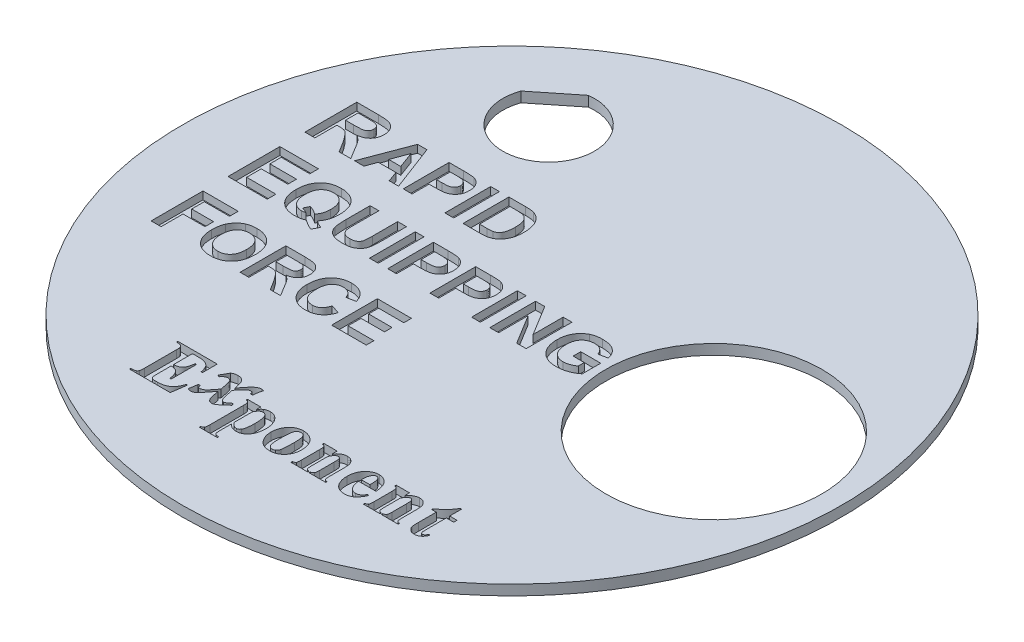
from build123d import *

# Parameters (mm, degrees)
SKETCH1_R           = 20.828
BOSS_EXTRUDE1_DEPTH = 1.27
CUT_EXTRUDE2_START  = -0.635
SKETCH2_R           = 20.828
SKETCH2_R_2         = 20.32
CUT_EXTRUDE2_DEPTH  = 0.635
CUT_EXTRUDE3_DEPTH  = 30.482606194
CUT_EXTRUDE5_DEPTH  = 30.482606194
BOSS_EXTRUDE2_START = -1.27
SKETCH16_R          = 22.86
SKETCH16_R_2        = 20.32
BOSS_EXTRUDE2_DEPTH = 1.27
SKETCH17_R          = 7.493
CUT_EXTRUDE6_DEPTH  = 33.353857575
SKETCH18_R          = 22.86
CUT_EXTRUDE7_DEPTH  = 0.5588
SKETCH20_W          = 0.610576923
SKETCH20_H          = 3.175
CUT_EXTRUDE8_DEPTH  = 0.5334


with BuildPart() as part:
    # Sketch1 → Boss-Extrude1 (new body)
    with BuildSketch(Plane(origin=(0, 0, 0), x_dir=(1, 0, 0), z_dir=(0, 1, 0))):
        with Locations(Location((0, 0, 0), (0, 0, 270))):
            Circle(SKETCH1_R)
    extrude(amount=BOSS_EXTRUDE1_DEPTH)

    # Sketch2 → Cut-Extrude2 (cut)
    with BuildSketch(Plane(origin=(0, 1.27, 0), x_dir=(1, 0, 0), z_dir=(0, 1, 0)).offset(CUT_EXTRUDE2_START)):
        with Locations(Location((0, 0, 0), (0, 0, 270))):
            Circle(SKETCH2_R)
        with Locations(Location((0, 0, 0), (0, 0, 270))):
            Circle(SKETCH2_R_2, mode=Mode.SUBTRACT)
    extrude(amount=CUT_EXTRUDE2_DEPTH, mode=Mode.SUBTRACT)

    # Sketch3 → Cut-Extrude3 (cut, through all)
    with BuildSketch(Plane(origin=(0, 1.27, 0), x_dir=(1, 0, 0), z_dir=(0, 1, 0))):
        with BuildLine():
            Line((18.66773, 2.835365662), (18.66773, -2.835365662))
            ThreePointArc((18.66773, -2.835365662), (14.00048, -5.461), (9.33323, -2.835365662))
            Line((9.33323, -2.835365662), (9.33323, 2.835365662))
            ThreePointArc((9.33323, 2.835365662), (14.00048, 5.461), (18.66773, 2.835365662))
        make_face()
    extrude(amount=-CUT_EXTRUDE3_DEPTH, mode=Mode.SUBTRACT)

    # Sketch13 → Cut-Extrude5 (cut, through all)
    with BuildSketch(Plane.XZ):
        with BuildLine():
            Line((-13.147857976, -13.773931894), (-10.55186717, -15.850724539))
            ThreePointArc((-10.55186717, -15.850724539), (-8.176593224, -10.22074153), (-13.147857976, -13.773931894))
        make_face()
    extrude(amount=-CUT_EXTRUDE5_DEPTH, mode=Mode.SUBTRACT)

    # Sketch16 → Boss-Extrude2 (add)
    with BuildSketch(Plane(origin=(0, 1.27, 0), x_dir=(1, 0, 0), z_dir=(0, 1, 0)).offset(BOSS_EXTRUDE2_START)):
        with Locations(Location((0, 0, 0), (0, 0, 270))):
            Circle(SKETCH16_R)
        Circle(SKETCH16_R_2, mode=Mode.SUBTRACT)
    extrude(amount=BOSS_EXTRUDE2_DEPTH)

    # Sketch17 → Cut-Extrude6 (cut, through all)
    with BuildSketch(Plane(origin=(0, 1.27, 0), x_dir=(1, 0, 0), z_dir=(0, 1, 0))):
        with Locations(Location((14.00048, 0, 0), (0, 0, 270))):
            Circle(SKETCH17_R)
    extrude(amount=-CUT_EXTRUDE6_DEPTH, mode=Mode.SUBTRACT)

    # Sketch18 → Cut-Extrude7 (cut)
    with BuildSketch(Plane.XZ):
        with Locations(Location((0, 0, 0), (0, 0, 90))):
            Circle(SKETCH18_R)
    extrude(amount=-CUT_EXTRUDE7_DEPTH, mode=Mode.SUBTRACT)

    # Sketch20 → Cut-Extrude8 (cut)
    # profile 1 of 27: a face of its own
    with BuildSketch(Plane(origin=(0, 1.27, 0), x_dir=(1, 0, 0), z_dir=(0, 1, 0))):
        with BuildLine():
            Line((-18.173215779, 3.81), (-18.173215779, 7.405646159))
            Line((-18.173215779, 7.405646159), (-16.664225654, 7.405646159))
            add(Edge.make_bspline(
                [(-16.664225654, 7.405646159), (-16.618365952, 7.405363527), (-16.529985914, 7.404818842), (-16.402171137, 7.400846897), (-16.284297222, 7.392525439), (-16.175841279, 7.38310132), (-16.07732423, 7.369389834), (-15.988356556, 7.352963609), (-15.909088041, 7.333927878), (-15.83836211, 7.311129504), (-15.773874428, 7.285035973), (-15.713800989, 7.25397733), (-15.657481267, 7.217588312), (-15.604050246, 7.177123149), (-15.553281667, 7.132519664), (-15.506567336, 7.082597429), (-15.463093365, 7.028099802), (-15.422894831, 6.969480207), (-15.387482439, 6.906997485), (-15.35512481, 6.842658281), (-15.32878448, 6.775777931), (-15.307027607, 6.70667149), (-15.28964788, 6.635488998), (-15.277584882, 6.562049484), (-15.270054082, 6.486485874), (-15.269381807, 6.435444846), (-15.269040035, 6.409496592)],
                knots=[0, 0, 0, 0, 1.675828044, 3.229627355, 4.67171229, 5.993455049, 7.206927059, 8.304770529, 9.29850117, 10.183580433, 11.017754134, 11.837875825, 12.650738409, 13.464925643, 14.285328857, 15.117007378, 15.959673368, 16.830859064, 17.711229498, 18.58228265, 19.460420693, 20.334473227, 21.228207035, 22.135446768, 23.052097822, 24, 24, 24, 24], degree=3))
            add(Edge.make_bspline(
                [(-15.269040035, 6.409496592), (-15.26967397, 6.376809054), (-15.270912854, 6.312928596), (-15.282313719, 6.219299724), (-15.299246916, 6.129844021), (-15.323385056, 6.044437553), (-15.356574509, 5.964084822), (-15.395103406, 5.887660201), (-15.441055589, 5.815422924), (-15.494118862, 5.748089113), (-15.55424572, 5.685599163), (-15.621699662, 5.629239071), (-15.695999089, 5.578788566), (-15.777593465, 5.534538579), (-15.865914646, 5.496709635), (-15.961345621, 5.464881513), (-16.063454374, 5.438976969), (-16.134481166, 5.426788106), (-16.170832701, 5.420549842)],
                knots=[0, 0, 0, 0, 1.05911256, 2.069797862, 3.05271628, 4.008392045, 4.940519534, 5.866323021, 6.779546087, 7.71056835, 8.640711998, 9.585328432, 10.554502533, 11.547017206, 12.589327225, 13.664782803, 14.804835066, 16, 16, 16, 16], degree=3))
            add(Edge.make_bspline(
                [(-16.170832701, 5.420549842), (-16.135676684, 5.397265681), (-16.066871568, 5.351695406), (-15.971674738, 5.276640592), (-15.886210572, 5.197864759), (-15.821501416, 5.127812388), (-15.771779099, 5.066208853), (-15.731744138, 5.012329808), (-15.688560015, 4.950322842), (-15.642650271, 4.880154358), (-15.592657699, 4.802445182), (-15.540441611, 4.716005855), (-15.484909313, 4.621679519), (-15.447572644, 4.555787797), (-15.428222287, 4.521638302)],
                knots=[0, 0, 0, 0, 1.285445069, 2.515791127, 3.691898215, 4.826622834, 5.420063933, 6.105349801, 6.873086501, 7.723915395, 8.66222816, 9.690593598, 10.803111229, 12, 12, 12, 12], degree=3))
            Line((-15.428222287, 4.521638302), (-14.992451869, 3.81))
            Line((-14.992451869, 3.81), (-15.800607917, 3.81))
            Line((-15.800607917, 3.81), (-16.312007911, 4.626079146))
            add(Edge.make_bspline(
                [(-16.312007911, 4.626079146), (-16.335494448, 4.658762527), (-16.380335074, 4.72116182), (-16.445065289, 4.809833241), (-16.504287691, 4.888766732), (-16.556426174, 4.959105598), (-16.604118923, 5.018855568), (-16.645917797, 5.069057877), (-16.680971407, 5.110789792), (-16.720634653, 5.152168787), (-16.76677863, 5.194694869), (-16.823901186, 5.235926325), (-16.882560753, 5.268795607), (-16.945409792, 5.293875642), (-17.018092807, 5.311363108), (-17.105469302, 5.322504847), (-17.210286598, 5.330725097), (-17.286048503, 5.33105636), (-17.326884802, 5.331234913)],
                knots=[0, 0, 0, 0, 1.465447777, 2.797841088, 3.997266218, 5.05856206, 5.985598736, 6.780315439, 7.437430484, 7.969193402, 8.866571936, 9.718200644, 10.52825214, 11.309096006, 12.174169268, 13.242355782, 14.513606761, 16, 16, 16, 16], degree=3))
            Line((-17.326884802, 5.331234913), (-17.481745363, 5.331234913))
            Line((-17.481745363, 5.331234913), (-17.481745363, 3.81))
            Line((-17.481745363, 3.81), (-18.173215779, 3.81))
        make_face()
        with BuildLine():
            Line((-17.481745363, 5.930509273), (-16.924967623, 5.930509273))
            add(Edge.make_bspline(
                [(-16.924967623, 5.930509273), (-16.881988741, 5.93060138), (-16.800106708, 5.930776858), (-16.683668828, 5.933318588), (-16.579650594, 5.935475902), (-16.488674477, 5.940896245), (-16.410333441, 5.946268316), (-16.344941754, 5.953250058), (-16.29194847, 5.961502253), (-16.239017088, 5.974332249), (-16.184797367, 5.996685984), (-16.127009403, 6.028524283), (-16.07761946, 6.06982719), (-16.034836362, 6.117577528), (-16.002198852, 6.173712393), (-15.976635963, 6.235730914), (-15.963675036, 6.305011196), (-15.961587415, 6.353031454), (-15.96051045, 6.377804198)],
                knots=[0, 0, 0, 0, 1.697953026, 3.23488743, 4.60134403, 5.807846676, 6.835100678, 7.703488618, 8.405232423, 8.952775585, 9.851109663, 10.713519226, 11.549115941, 12.382556273, 13.233359028, 14.101746968, 15.020727134, 16, 16, 16, 16], degree=3))
            add(Edge.make_bspline(
                [(-15.96051045, 6.377804198), (-15.961735295, 6.405517633), (-15.964098435, 6.458986238), (-15.982734495, 6.535072573), (-16.015262979, 6.602284374), (-16.059936934, 6.660732609), (-16.116018047, 6.710087143), (-16.182816853, 6.749263899), (-16.259837086, 6.778441122), (-16.315389052, 6.789216214), (-16.344420587, 6.794847292)],
                knots=[0, 0, 0, 0, 1.062977961, 2.050844577, 2.982300261, 3.90936959, 4.856017476, 5.831122378, 6.86654153, 8, 8, 8, 8], degree=3))
            add(Edge.make_bspline(
                [(-16.344420587, 6.794847292), (-16.35401699, 6.795901731), (-16.376762481, 6.798400971), (-16.41692832, 6.800006124), (-16.468285499, 6.802473418), (-16.531455645, 6.803481746), (-16.605874399, 6.805249256), (-16.691837683, 6.805573816), (-16.789072386, 6.806610761), (-16.857740917, 6.806454369), (-16.893995511, 6.806371799)],
                knots=[0, 0, 0, 0, 0.42127143, 0.998501726, 1.753681744, 2.66564073, 3.755712164, 5.002818897, 6.417592707, 8, 8, 8, 8], degree=3))
            Line((-16.893995511, 6.806371799), (-17.481745363, 6.806371799))
            Line((-17.481745363, 6.806371799), (-17.481745363, 5.930509273))
        make_face(mode=Mode.SUBTRACT)
    # profile 2 of 27: a face of its own
    with BuildSketch(Plane(origin=(0, 1.27, 0), x_dir=(1, 0, 0), z_dir=(0, 1, 0))):
        Polygon((-18.173215779, -1.524), (-18.173215779, 2.071646159), (-15.499530173, 2.071646159), (-15.499530173, 1.472371799), (-17.481745363, 1.472371799), (-17.481745363, 0.688705329), (-15.637824256, 0.688705329), (-15.637824256, 0.089430969), (-17.481745363, 0.089430969), (-17.481745363, -0.92472564), (-15.453432146, -0.92472564), (-15.453432146, -1.524), align=None)
    # profile 3 of 27: a face of its own
    with BuildSketch(Plane(origin=(0, 1.27, 0), x_dir=(1, 0, 0), z_dir=(0, 1, 0))):
        Polygon((-18.173215779, -6.858), (-18.173215779, -3.262353841), (-15.730020312, -3.262353841), (-15.730020312, -3.861628201), (-17.481745363, -3.861628201), (-17.481745363, -4.737490727), (-15.96051045, -4.737490727), (-15.96051045, -5.336765087), (-17.481745363, -5.336765087), (-17.481745363, -6.858), align=None)
    # profile 4 of 27: a face of its own
    with BuildSketch(Plane(origin=(0, 1.27, 0), x_dir=(1, 0, 0), z_dir=(0, 1, 0))):
        Polygon((-11.679115385, 3.81), (-12.32658133, 3.81), (-12.594344752, 4.542692308), (-13.812954527, 4.542692308), (-14.080717949, 3.81), (-14.732, 3.81), (-13.531834736, 6.985), (-12.885004808, 6.985), align=None)
        Polygon((-12.788330128, 5.071858974), (-13.205557692, 6.211602564), (-13.621513221, 5.071858974), align=None, mode=Mode.SUBTRACT)
    # profile 5 of 27: a face of its own
    with BuildSketch(Plane(origin=(0, 1.27, 0), x_dir=(1, 0, 0), z_dir=(0, 1, 0))):
        with BuildLine():
            Line((-11.353474359, 3.81), (-11.353474359, 6.985))
            Line((-11.353474359, 6.985), (-10.337754207, 6.985))
            add(Edge.make_bspline(
                [(-10.337754207, 6.985), (-10.291747428, 6.984949758), (-10.203753994, 6.984853665), (-10.078236683, 6.9821838), (-9.965227149, 6.97840431), (-9.864893116, 6.973697116), (-9.776881535, 6.966673079), (-9.701587217, 6.958539349), (-9.638536037, 6.949789614), (-9.601407066, 6.940734809), (-9.584709335, 6.93666266)],
                knots=[0, 0, 0, 0, 1.460485487, 2.793352117, 3.985295279, 5.050041172, 5.981765236, 6.787433016, 7.454681457, 8, 8, 8, 8], degree=3))
            add(Edge.make_bspline(
                [(-9.584709335, 6.93666266), (-9.562505414, 6.930331467), (-9.518435832, 6.917765531), (-9.455297864, 6.890976951), (-9.394442861, 6.859930417), (-9.336635401, 6.82292856), (-9.281678978, 6.780628294), (-9.229410236, 6.733374582), (-9.179550433, 6.680954113), (-9.132789317, 6.623470439), (-9.089961635, 6.561213423), (-9.052947757, 6.494091019), (-9.021937866, 6.422394976), (-8.995517955, 6.346664081), (-8.976025219, 6.266086375), (-8.962383847, 6.181221722), (-8.95288775, 6.092033004), (-8.952215397, 6.030999519), (-8.951871795, 5.999808694)],
                knots=[0, 0, 0, 0, 0.907145743, 1.80047177, 2.69161667, 3.591261238, 4.495029544, 5.415863088, 6.359363025, 7.337192411, 8.326890979, 9.326929023, 10.346104993, 11.395420813, 12.477187422, 13.601053412, 14.774031606, 16, 16, 16, 16], degree=3))
            add(Edge.make_bspline(
                [(-8.951871795, 5.999808694), (-8.952851747, 5.95244188), (-8.954738208, 5.861258162), (-8.975844364, 5.730535251), (-9.008036443, 5.611128299), (-9.055087494, 5.504187442), (-9.112452498, 5.409293027), (-9.175641232, 5.323746161), (-9.247793479, 5.250125311), (-9.325747618, 5.187242374), (-9.408130895, 5.135781587), (-9.490663303, 5.091911996), (-9.574458496, 5.058183654), (-9.631589872, 5.043487943), (-9.659759415, 5.036241987)],
                knots=[0, 0, 0, 0, 1.312386234, 2.526415563, 3.661883817, 4.733421185, 5.753802465, 6.732107337, 7.675884281, 8.604170108, 9.50284679, 10.365392406, 11.194030444, 12, 12, 12, 12], degree=3))
            add(Edge.make_bspline(
                [(-9.659759415, 5.036241987), (-9.679865454, 5.032417346), (-9.722246584, 5.024355459), (-9.789460521, 5.016319225), (-9.862928997, 5.00742399), (-9.942954193, 5.001622018), (-10.029439299, 4.996188715), (-10.122350733, 4.993623473), (-10.221555714, 4.990532877), (-10.289837817, 4.990477343), (-10.325033854, 4.990448718)],
                knots=[0, 0, 0, 0, 0.735353946, 1.55003838, 2.431865514, 3.394945452, 4.432993119, 5.54609699, 6.735134699, 8, 8, 8, 8], degree=3))
            Line((-10.325033854, 4.990448718), (-10.742897436, 4.990448718))
            Line((-10.742897436, 4.990448718), (-10.742897436, 3.81))
            Line((-10.742897436, 3.81), (-11.353474359, 3.81))
        make_face()
        with BuildLine():
            Line((-10.742897436, 6.455833333), (-10.742897436, 5.519615385))
            Line((-10.742897436, 5.519615385), (-10.376551282, 5.519615385))
            add(Edge.make_bspline(
                [(-10.376551282, 5.519615385), (-10.344959632, 5.519656293), (-10.284520831, 5.519734556), (-10.197804557, 5.522543744), (-10.119308905, 5.525972879), (-10.048869859, 5.531648799), (-9.986912608, 5.539129525), (-9.93302224, 5.548077416), (-9.887135947, 5.557679438), (-9.837516168, 5.573591528), (-9.784462703, 5.599335837), (-9.727807838, 5.636336876), (-9.678036606, 5.680575981), (-9.636620344, 5.732533279), (-9.60353792, 5.790260847), (-9.57985088, 5.853167074), (-9.564556181, 5.920209385), (-9.56315915, 5.966651331), (-9.562448718, 5.990268429)],
                knots=[0, 0, 0, 0, 1.411705958, 2.700771114, 3.876961699, 4.922619712, 5.858038221, 6.66485904, 7.363650596, 7.950905807, 8.989198271, 9.987739806, 10.967313358, 11.951275539, 12.944273208, 13.927870418, 14.946261014, 16, 16, 16, 16], degree=3))
            add(Edge.make_bspline(
                [(-9.562448718, 5.990268429), (-9.563448573, 6.019033687), (-9.565387159, 6.074805729), (-9.586764353, 6.154234424), (-9.619746921, 6.226316929), (-9.66690263, 6.288810429), (-9.723865616, 6.341362324), (-9.787889635, 6.385087369), (-9.860341948, 6.415686488), (-9.911618767, 6.427542517), (-9.937699119, 6.433572716)],
                knots=[0, 0, 0, 0, 1.085904563, 2.105425768, 3.088705091, 4.068969419, 5.045188284, 6.010769642, 6.988240112, 8, 8, 8, 8], degree=3))
            add(Edge.make_bspline(
                [(-9.937699119, 6.433572716), (-9.94892209, 6.435367739), (-9.973833607, 6.439352133), (-10.015241617, 6.443510344), (-10.0642273, 6.447292232), (-10.120849703, 6.450397275), (-10.184884388, 6.4528247), (-10.256542572, 6.454951723), (-10.335635528, 6.455122601), (-10.3909682, 6.455589859), (-10.419800481, 6.455833333)],
                knots=[0, 0, 0, 0, 0.564603001, 1.253243608, 2.066786758, 3.005752288, 4.070476343, 5.250658742, 6.567396469, 8, 8, 8, 8], degree=3))
            Line((-10.419800481, 6.455833333), (-10.742897436, 6.455833333))
        make_face(mode=Mode.SUBTRACT)
    # profile 6 of 27: a face of its own
    with BuildSketch(Plane(origin=(0, 1.27, 0), x_dir=(1, 0, 0), z_dir=(0, 1, 0))):
        with Locations((-8.158121795, 5.3975)):
            Rectangle(SKETCH20_W, SKETCH20_H)
    # profile 7 of 27: a face of its own
    with BuildSketch(Plane(origin=(0, 1.27, 0), x_dir=(1, 0, 0), z_dir=(0, 1, 0))):
        with BuildLine():
            Line((-7.201551282, 6.985), (-6.037003005, 6.985))
            add(Edge.make_bspline(
                [(-6.037003005, 6.985), (-6.005197301, 6.985016488), (-5.943264207, 6.985048595), (-5.853383073, 6.981319834), (-5.769332657, 6.97756919), (-5.691354205, 6.970061221), (-5.619177186, 6.962191539), (-5.55267208, 6.952227929), (-5.492259004, 6.939458472), (-5.454162553, 6.929388228), (-5.435966346, 6.924578325)],
                knots=[0, 0, 0, 0, 1.259756885, 2.453039283, 3.563158368, 4.591894114, 5.55549294, 6.43918076, 7.254497783, 8, 8, 8, 8], degree=3))
            add(Edge.make_bspline(
                [(-5.435966346, 6.924578325), (-5.413210878, 6.917161963), (-5.368109822, 6.902462825), (-5.301990286, 6.876707488), (-5.239345469, 6.844765676), (-5.177851322, 6.811188889), (-5.120253119, 6.771488244), (-5.063502651, 6.730185038), (-5.011282931, 6.682339593), (-4.942803485, 6.615472435), (-4.864663232, 6.522324368), (-4.782799409, 6.398768138), (-4.713509831, 6.263148176), (-4.666168005, 6.141637413), (-4.634200966, 6.038343), (-4.613304462, 5.955527073), (-4.595554152, 5.868291056), (-4.580981093, 5.776612957), (-4.569658246, 5.680492763), (-4.561228266, 5.579956095), (-4.557122015, 5.474916103), (-4.556192292, 5.403438805), (-4.555717949, 5.366971154)],
                knots=[0, 0, 0, 0, 0.745524535, 1.477620414, 2.207090574, 2.934465325, 3.657932502, 4.384347339, 5.118673636, 5.861150177, 7.365375624, 8.894729774, 10.468936425, 12.099947606, 12.950091786, 13.83580991, 14.759228729, 15.722225242, 16.726454549, 17.773376212, 18.863978586, 20, 20, 20, 20], degree=3))
            add(Edge.make_bspline(
                [(-4.555717949, 5.366971154), (-4.556583844, 5.303943859), (-4.558258467, 5.182050335), (-4.577659087, 5.00615849), (-4.605617832, 4.842786883), (-4.637133137, 4.740868572), (-4.652392628, 4.691520433)],
                knots=[0, 0, 0, 0, 1.103207939, 2.133582005, 3.096293362, 4, 4, 4, 4], degree=3))
            add(Edge.make_bspline(
                [(-4.652392628, 4.691520433), (-4.662468949, 4.663203395), (-4.682290643, 4.607499364), (-4.716977123, 4.527146025), (-4.754456109, 4.450677939), (-4.795038474, 4.378155353), (-4.838929253, 4.309904476), (-4.886292613, 4.246129449), (-4.936394384, 4.185990655), (-4.972690219, 4.148974943), (-4.990754006, 4.130552885)],
                knots=[0, 0, 0, 0, 1.090884612, 2.145940218, 3.175104604, 4.181306866, 5.161203701, 6.118658341, 7.063689906, 8, 8, 8, 8], degree=3))
            add(Edge.make_bspline(
                [(-4.990754006, 4.130552885), (-5.019985579, 4.104264701), (-5.080265249, 4.050054721), (-5.186488351, 3.982967703), (-5.306550325, 3.92368777), (-5.393395817, 3.893236652), (-5.438510417, 3.877417869)],
                knots=[0, 0, 0, 0, 0.908140292, 1.872714733, 2.8949153, 4, 4, 4, 4], degree=3))
            add(Edge.make_bspline(
                [(-5.438510417, 3.877417869), (-5.456671333, 3.87184011), (-5.494363374, 3.860263762), (-5.554127823, 3.847899982), (-5.617927871, 3.834874618), (-5.686499222, 3.827027938), (-5.759130072, 3.818753266), (-5.836399222, 3.814107501), (-5.91803882, 3.810809277), (-5.974033418, 3.810273759), (-6.002658053, 3.81)],
                knots=[0, 0, 0, 0, 0.799129865, 1.658552685, 2.566799617, 3.538529252, 4.561352959, 5.643373779, 6.795284424, 8, 8, 8, 8], degree=3))
            Line((-6.002658053, 3.81), (-7.201551282, 3.81))
            Line((-7.201551282, 3.81), (-7.201551282, 6.985))
        make_face()
        with BuildLine():
            Line((-6.590974359, 6.455833333), (-6.590974359, 4.339166667))
            Line((-6.590974359, 4.339166667), (-6.088520433, 4.339166667))
            add(Edge.make_bspline(
                [(-6.088520433, 4.339166667), (-6.065835955, 4.33934657), (-6.02215967, 4.339692953), (-5.958958967, 4.340710757), (-5.900878052, 4.343466145), (-5.847612663, 4.346320277), (-5.79930147, 4.351035804), (-5.755734262, 4.355673704), (-5.717153557, 4.36216203), (-5.693325165, 4.367283828), (-5.682105168, 4.369695513)],
                knots=[0, 0, 0, 0, 1.333384787, 2.567275092, 3.714769766, 4.750907381, 5.701951617, 6.567520054, 7.325492842, 8, 8, 8, 8], degree=3))
            add(Edge.make_bspline(
                [(-5.682105168, 4.369695513), (-5.655826663, 4.376707922), (-5.604643067, 4.390366244), (-5.532776124, 4.420814576), (-5.467745799, 4.457547157), (-5.408463034, 4.501716507), (-5.355036991, 4.55753635), (-5.309431332, 4.628925551), (-5.267224497, 4.714067245), (-5.238321247, 4.795569139), (-5.217574549, 4.868364724), (-5.203530736, 4.929463856), (-5.192432291, 4.995566938), (-5.182886181, 5.066413085), (-5.175172696, 5.141911193), (-5.170373002, 5.222333898), (-5.16709718, 5.307582755), (-5.166567374, 5.366119801), (-5.166294872, 5.396227965)],
                knots=[0, 0, 0, 0, 1.038686998, 2.023088296, 2.974059649, 3.888265163, 4.839857954, 5.909819677, 7.113156087, 8.466843969, 9.20827164, 10.006482943, 10.861893492, 11.769681931, 12.739021491, 13.762258324, 14.849031541, 16, 16, 16, 16], degree=3))
            add(Edge.make_bspline(
                [(-5.166294872, 5.396227965), (-5.166565279, 5.426336221), (-5.167089107, 5.484661587), (-5.170359904, 5.569274788), (-5.175132639, 5.648431059), (-5.182901056, 5.722228251), (-5.192299186, 5.790768354), (-5.203527631, 5.854109371), (-5.217486785, 5.911835614), (-5.238251129, 5.980415457), (-5.269728806, 6.057501331), (-5.312563781, 6.141782856), (-5.365166604, 6.213618373), (-5.423287601, 6.276023062), (-5.490302093, 6.327378967), (-5.564486973, 6.370392528), (-5.647457459, 6.403777965), (-5.706476972, 6.417997917), (-5.736802684, 6.425304487)],
                knots=[0, 0, 0, 0, 1.117996097, 2.165769068, 3.143980016, 4.062055362, 4.920439205, 5.712587309, 6.449616741, 7.124491204, 8.371470382, 9.537068822, 10.625202851, 11.666538334, 12.693249444, 13.747832046, 14.842779399, 16, 16, 16, 16], degree=3))
            add(Edge.make_bspline(
                [(-5.736802684, 6.425304487), (-5.74992913, 6.427743565), (-5.778828538, 6.433113479), (-5.826784326, 6.439385571), (-5.88304715, 6.444039999), (-5.947903828, 6.448791761), (-6.021091749, 6.451503917), (-6.10291715, 6.454334493), (-6.193037629, 6.455301412), (-6.256005301, 6.455650931), (-6.288865986, 6.455833333)],
                knots=[0, 0, 0, 0, 0.578738571, 1.274160813, 2.095454135, 3.025967819, 4.093109015, 5.270126069, 6.575371698, 8, 8, 8, 8], degree=3))
            Line((-6.288865986, 6.455833333), (-6.590974359, 6.455833333))
        make_face(mode=Mode.SUBTRACT)
    # profile 8 of 27: a face of its own
    with BuildSketch(Plane(origin=(0, 1.27, 0), x_dir=(1, 0, 0), z_dir=(0, 1, 0))):
        with BuildLine():
            add(Edge.make_bspline(
                [(-12.409085537, -1.095960136), (-12.369828617, -1.122868136), (-12.291162242, -1.17678869), (-12.166036216, -1.246541749), (-12.036932572, -1.309954248), (-11.947208765, -1.34406199), (-11.902179487, -1.361179487)],
                knots=[0, 0, 0, 0, 0.994855506, 1.99357661, 2.993045438, 4, 4, 4, 4], degree=3))
            Line((-11.902179487, -1.361179487), (-12.135597957, -1.808935897))
            add(Edge.make_bspline(
                [(-12.135597957, -1.808935897), (-12.183317572, -1.794164235), (-12.279515438, -1.764386073), (-12.37032093, -1.720846377), (-12.416081731, -1.698904848)],
                knots=[0, 0, 0, 0, 0.992113803, 2, 2, 2, 2], degree=3))
            add(Edge.make_bspline(
                [(-12.416081731, -1.698904848), (-12.420572207, -1.696639222), (-12.433576021, -1.690078274), (-12.457195652, -1.673926781), (-12.493233469, -1.652157326), (-12.540144928, -1.622003865), (-12.598402108, -1.58462855), (-12.668193497, -1.540071705), (-12.748556603, -1.487073506), (-12.806350696, -1.449745914), (-12.837125401, -1.429869391)],
                knots=[0, 0, 0, 0, 0.241377655, 0.698997227, 1.371388316, 2.263975901, 3.376788369, 4.695767198, 6.240533187, 8, 8, 8, 8], degree=3))
            add(Edge.make_bspline(
                [(-12.837125401, -1.429869391), (-12.86264823, -1.440799666), (-12.913940613, -1.462765876), (-12.993522961, -1.489814248), (-13.075129041, -1.512599813), (-13.158468928, -1.531923452), (-13.243895358, -1.546281488), (-13.331287568, -1.557292445), (-13.420890541, -1.56374987), (-13.481401042, -1.564384724), (-13.511940104, -1.564705128)],
                knots=[0, 0, 0, 0, 0.961025642, 1.931341354, 2.907359807, 3.893838693, 4.891829695, 5.905170566, 6.942759923, 8, 8, 8, 8], degree=3))
            add(Edge.make_bspline(
                [(-13.511940104, -1.564705128), (-13.569868695, -1.563295216), (-13.683102566, -1.560539239), (-13.84821203, -1.541006891), (-14.003352376, -1.507151918), (-14.149204558, -1.460908689), (-14.284891833, -1.400202686), (-14.411604494, -1.32682301), (-14.527588199, -1.238865819), (-14.634440987, -1.13902685), (-14.728974968, -1.026182192), (-14.811732838, -0.902301632), (-14.881839997, -0.767795823), (-14.938370126, -0.62195644), (-14.983047152, -0.465962736), (-15.013507588, -0.298713494), (-15.033112209, -0.121200622), (-15.035334905, 0.000903803), (-15.036474359, 0.0635)],
                knots=[0, 0, 0, 0, 1.098101164, 2.146474535, 3.146072545, 4.104420533, 5.041773038, 5.958565538, 6.874115049, 7.795336865, 8.725215067, 9.658214839, 10.614563411, 11.594512188, 12.618591104, 13.685899083, 14.813688224, 16, 16, 16, 16], degree=3))
            add(Edge.make_bspline(
                [(-15.036474359, 0.0635), (-15.03533232, 0.126093643), (-15.033112275, 0.247771414), (-15.013641538, 0.424942288), (-14.982165341, 0.591593983), (-14.937943867, 0.747835561), (-14.880567051, 0.893256532), (-14.810185821, 1.027775452), (-14.727297841, 1.151917393), (-14.631643225, 1.264513241), (-14.525356933, 1.365373904), (-14.409036266, 1.452677346), (-14.28403365, 1.527217554), (-14.149852061, 1.587866226), (-14.006121086, 1.634083972), (-13.85393513, 1.667831165), (-13.692451688, 1.687602342), (-13.581956785, 1.690314414), (-13.525296474, 1.691705128)],
                knots=[0, 0, 0, 0, 1.193283781, 2.319662245, 3.393996131, 4.424093603, 5.411284417, 6.369670503, 7.313761776, 8.251713527, 9.181123148, 10.102053383, 11.01932051, 11.951118596, 12.903560284, 13.893239571, 14.919681386, 16, 16, 16, 16], degree=3))
            add(Edge.make_bspline(
                [(-13.525296474, 1.691705128), (-13.469043126, 1.690682569), (-13.359325656, 1.688688152), (-13.199342154, 1.667357403), (-13.048171977, 1.634993395), (-12.905635305, 1.588340647), (-12.772462444, 1.52775342), (-12.647960324, 1.454192961), (-12.532855052, 1.367037877), (-12.427114048, 1.26713966), (-12.332539441, 1.154932302), (-12.248759541, 1.032261271), (-12.179974472, 0.897614303), (-12.122027304, 0.753275863), (-12.078830711, 0.597838231), (-12.046942846, 0.432192512), (-12.027741954, 0.255816787), (-12.025463229, 0.134570244), (-12.024294872, 0.072404247)],
                knots=[0, 0, 0, 0, 1.078752742, 2.104017338, 3.091035458, 4.041673215, 4.975566109, 5.892967701, 6.810684895, 7.740128604, 8.678185021, 9.621404646, 10.583875016, 11.573429805, 12.6009998, 13.674031063, 14.80742018, 16, 16, 16, 16], degree=3))
            add(Edge.make_bspline(
                [(-12.024294872, 0.072404247), (-12.025555189, 0.006831571), (-12.028005208, -0.120639755), (-12.049327613, -0.305756888), (-12.083891946, -0.479123131), (-12.1195012, -0.588068345), (-12.136869992, -0.641207532)],
                knots=[0, 0, 0, 0, 1.083667057, 2.106616435, 3.076482036, 4, 4, 4, 4], degree=3))
            add(Edge.make_bspline(
                [(-12.136869992, -0.641207532), (-12.152439611, -0.680348908), (-12.184113184, -0.759974953), (-12.246720233, -0.874910253), (-12.321209982, -0.988302941), (-12.379378446, -1.059565691), (-12.409085537, -1.095960136)],
                knots=[0, 0, 0, 0, 0.948216854, 1.928975575, 2.942311585, 4, 4, 4, 4], degree=3))
        make_face()
        with BuildLine():
            add(Edge.make_bspline(
                [(-12.918535657, -0.769047075), (-12.895579433, -0.743949949), (-12.849612044, -0.693695633), (-12.792768947, -0.607618967), (-12.743140806, -0.515311712), (-12.704122129, -0.414470916), (-12.672741014, -0.306632163), (-12.650839645, -0.190993687), (-12.637237263, -0.067846187), (-12.63567461, 0.016821704), (-12.634871795, 0.060319912)],
                knots=[0, 0, 0, 0, 0.906820982, 1.815812261, 2.745108282, 3.70056618, 4.696560745, 5.740060838, 6.83895416, 8, 8, 8, 8], degree=3))
            add(Edge.make_bspline(
                [(-12.634871795, 0.060319912), (-12.635575901, 0.105075252), (-12.636939867, 0.191773493), (-12.648237405, 0.317671794), (-12.668118286, 0.434698452), (-12.694065203, 0.543341616), (-12.729417426, 0.64272196), (-12.772052016, 0.733588566), (-12.822036046, 0.81616501), (-12.880597819, 0.889088874), (-12.945010279, 0.953199326), (-13.01386632, 1.009834127), (-13.088171832, 1.057240956), (-13.167548364, 1.095376812), (-13.251331667, 1.125384041), (-13.339720247, 1.147168604), (-13.432913478, 1.159916791), (-13.496636512, 1.161653406), (-13.52911258, 1.162538462)],
                knots=[0, 0, 0, 0, 1.335693338, 2.587451293, 3.768164612, 4.876224393, 5.916940853, 6.910477009, 7.867661778, 8.790666633, 9.694493319, 10.576027549, 11.446684429, 12.318352473, 13.199023277, 14.098364444, 15.030842682, 16, 16, 16, 16], degree=3))
            add(Edge.make_bspline(
                [(-13.52911258, 1.162538462), (-13.561806075, 1.161682127), (-13.625751897, 1.160007205), (-13.719036841, 1.146949892), (-13.807627124, 1.126214663), (-13.891305862, 1.095970388), (-13.970829547, 1.057762187), (-14.045412698, 1.01044317), (-14.115044921, 0.95469766), (-14.179781772, 0.890991999), (-14.237601202, 0.818045053), (-14.288998108, 0.736906483), (-14.331487327, 0.646642406), (-14.365607654, 0.547759282), (-14.392875326, 0.440765274), (-14.412511274, 0.32508621), (-14.423823564, 0.200895859), (-14.4251923, 0.115253087), (-14.425897436, 0.071132212)],
                knots=[0, 0, 0, 0, 0.980107447, 1.917010591, 2.819119613, 3.703969481, 4.579773866, 5.459928929, 6.346604172, 7.250235365, 8.177620171, 9.131899985, 10.124404622, 11.161948974, 12.264485933, 13.431998172, 14.677033863, 16, 16, 16, 16], degree=3))
            add(Edge.make_bspline(
                [(-14.425897436, 0.071132212), (-14.425209654, 0.026373068), (-14.423874067, -0.060543709), (-14.412315479, -0.186565243), (-14.393576886, -0.303979922), (-14.36690216, -0.412739148), (-14.332797435, -0.512967168), (-14.290789594, -0.604524313), (-14.241101346, -0.687296089), (-14.183572751, -0.760531478), (-14.120285837, -0.824960869), (-14.052661075, -0.881129331), (-13.981247358, -0.929245544), (-13.905711556, -0.968339867), (-13.826033411, -0.9983632), (-13.742490776, -1.020031607), (-13.654597471, -1.032947087), (-13.594665694, -1.034663098), (-13.56409355, -1.035538462)],
                knots=[0, 0, 0, 0, 1.356840463, 2.634818045, 3.833173645, 4.958776583, 6.025986406, 7.038359119, 8.007356852, 8.946032033, 9.855123386, 10.740685277, 11.607120956, 12.460971081, 13.313368256, 14.183325659, 15.073285775, 16, 16, 16, 16], degree=3))
            add(Edge.make_bspline(
                [(-13.56409355, -1.035538462), (-13.541166182, -1.035136197), (-13.496004036, -1.03434382), (-13.429281995, -1.025436825), (-13.364287777, -1.012560652), (-13.32230867, -0.99944976), (-13.301418269, -0.99292528)],
                knots=[0, 0, 0, 0, 1.028828871, 2.026578908, 3.017950568, 4, 4, 4, 4], degree=3))
            add(Edge.make_bspline(
                [(-13.301418269, -0.99292528), (-13.333446085, -0.976190344), (-13.396869438, -0.943050846), (-13.494925025, -0.900825084), (-13.593176537, -0.862780645), (-13.659999583, -0.842226524), (-13.693205128, -0.832012821)],
                knots=[0, 0, 0, 0, 1.021704821, 2.023239566, 3.017713044, 4, 4, 4, 4], degree=3))
            Line((-13.693205128, -0.832012821), (-13.51575621, -0.465666667))
            add(Edge.make_bspline(
                [(-13.51575621, -0.465666667), (-13.463863397, -0.483599316), (-13.359576912, -0.519637698), (-13.208930445, -0.59119754), (-13.060383328, -0.672642582), (-12.96617379, -0.736670583), (-12.918535657, -0.769047075)],
                knots=[0, 0, 0, 0, 0.979271047, 1.967993817, 2.972492781, 4, 4, 4, 4], degree=3))
        make_face(mode=Mode.SUBTRACT)
    # profile 9 of 27: a face of its own
    with BuildSketch(Plane(origin=(0, 1.27, 0), x_dir=(1, 0, 0), z_dir=(0, 1, 0))):
        with BuildLine():
            Line((-11.495128205, 1.651), (-10.884551282, 1.651))
            Line((-10.884551282, 1.651), (-10.884551282, -0.071971755))
            add(Edge.make_bspline(
                [(-10.884551282, -0.071971755), (-10.884318186, -0.104620624), (-10.883873185, -0.166950413), (-10.883566865, -0.256000487), (-10.881871655, -0.335953679), (-10.878195425, -0.406938823), (-10.875672326, -0.468919717), (-10.870987207, -0.521907738), (-10.866313443, -0.56588225), (-10.861769421, -0.592038653), (-10.859746595, -0.603682492)],
                knots=[0, 0, 0, 0, 1.470600056, 2.807515117, 4.011048972, 5.072079398, 6.00911328, 6.804506435, 7.467811572, 8, 8, 8, 8], degree=3))
            add(Edge.make_bspline(
                [(-10.859746595, -0.603682492), (-10.851406983, -0.635072581), (-10.834985236, -0.69688363), (-10.789720862, -0.781377693), (-10.729927262, -0.855853888), (-10.668935586, -0.908967404), (-10.613763917, -0.946557209), (-10.566900105, -0.969434907), (-10.517177906, -0.990289399), (-10.463546167, -1.006290874), (-10.406580496, -1.020292741), (-10.345592808, -1.028388718), (-10.281097803, -1.03460218), (-10.236890584, -1.035220786), (-10.214188702, -1.035538462)],
                knots=[0, 0, 0, 0, 1.376921055, 2.711331395, 4.038631339, 5.418057255, 6.132954575, 6.870556231, 7.630397752, 8.422890386, 9.247036838, 10.121396817, 11.035274583, 12, 12, 12, 12], degree=3))
            add(Edge.make_bspline(
                [(-10.214188702, -1.035538462), (-10.191284985, -1.03512306), (-10.146691916, -1.034314281), (-10.082068946, -1.029497721), (-10.02177682, -1.020410532), (-9.965852421, -1.008495473), (-9.914000376, -0.993436835), (-9.866634352, -0.974370829), (-9.823828991, -0.951426619), (-9.773533337, -0.916844026), (-9.71941528, -0.86805924), (-9.667333559, -0.801730093), (-9.630059079, -0.728509929), (-9.612575768, -0.661654443), (-9.603589933, -0.603405311), (-9.598115279, -0.552435298), (-9.593108432, -0.494754929), (-9.588561831, -0.430522189), (-9.585452539, -0.359688864), (-9.583770778, -0.282075813), (-9.582447223, -0.197695413), (-9.582144183, -0.139178189), (-9.581987179, -0.108860777)],
                knots=[0, 0, 0, 0, 1.036876239, 2.018776863, 2.930845756, 3.794842666, 4.605604932, 5.371924355, 6.101864688, 6.799283669, 8.1310906, 9.382718023, 10.597336334, 11.822035891, 12.492591141, 13.265194674, 14.141890321, 15.11351293, 16.179860579, 17.351049011, 18.627594861, 20, 20, 20, 20], degree=3))
            Line((-9.581987179, -0.108860777), (-9.581987179, 1.651))
            Line((-9.581987179, 1.651), (-8.971410256, 1.651))
            Line((-8.971410256, 1.651), (-8.971410256, -0.009642027))
            add(Edge.make_bspline(
                [(-8.971410256, -0.009642027), (-8.971488515, -0.055435755), (-8.971638888, -0.143427144), (-8.973986742, -0.270024799), (-8.978976679, -0.386172841), (-8.98315532, -0.492070363), (-8.991215747, -0.587447212), (-8.999654987, -0.672362688), (-9.010526649, -0.746801951), (-9.02602974, -0.831412991), (-9.052083694, -0.926341134), (-9.094073708, -1.031201442), (-9.147738209, -1.126601876), (-9.212863354, -1.212908478), (-9.28907397, -1.290464275), (-9.377511149, -1.358964371), (-9.477265497, -1.419241532), (-9.568678835, -1.462644855), (-9.648379555, -1.49187123), (-9.713294458, -1.511650331), (-9.782768289, -1.528122185), (-9.856719568, -1.541194065), (-9.93518007, -1.552215594), (-10.018178282, -1.55957617), (-10.105588638, -1.564169688), (-10.165209258, -1.564523779), (-10.195744191, -1.564705128)],
                knots=[0, 0, 0, 0, 1.415574045, 2.719986624, 3.913607924, 5.00929969, 5.995467356, 6.871900228, 7.64671288, 8.320227872, 9.530145585, 10.682614022, 11.803571353, 12.90325401, 14.015460715, 15.154679255, 16.351678057, 17.612271512, 18.275764165, 18.974412946, 19.708786676, 20.481351116, 21.295095879, 22.157200529, 23.056203067, 24, 24, 24, 24], degree=3))
            add(Edge.make_bspline(
                [(-10.195744191, -1.564705128), (-10.232423778, -1.564236268), (-10.303477605, -1.563328015), (-10.406618143, -1.559276379), (-10.502718877, -1.550913646), (-10.592081738, -1.539610629), (-10.67466983, -1.525080231), (-10.750692082, -1.507709232), (-10.819541566, -1.48575474), (-10.901546827, -1.454398417), (-10.99295537, -1.406433755), (-11.092457436, -1.342449287), (-11.179803139, -1.270231453), (-11.254225016, -1.190485914), (-11.316438808, -1.106015108), (-11.367007629, -1.01864689), (-11.407531817, -0.92983749), (-11.424465124, -0.86811322), (-11.432798478, -0.837736979)],
                knots=[0, 0, 0, 0, 1.128613534, 2.186292659, 3.174878439, 4.095586888, 4.95671962, 5.754129884, 6.492676435, 7.178284149, 8.453103036, 9.659838108, 10.813193309, 11.929983019, 13.007587775, 14.033493319, 15.032227051, 16, 16, 16, 16], degree=3))
            add(Edge.make_bspline(
                [(-11.432798478, -0.837736979), (-11.437898784, -0.813822101), (-11.448641659, -0.763449719), (-11.460842584, -0.683367507), (-11.471973422, -0.595183578), (-11.47957593, -0.498793628), (-11.486782411, -0.394503482), (-11.49195641, -0.282116503), (-11.494083963, -0.161658208), (-11.494773112, -0.078544283), (-11.495128205, -0.03571875)],
                knots=[0, 0, 0, 0, 0.728071598, 1.533551606, 2.411422299, 3.374601532, 4.412367648, 5.524718474, 6.72457895, 8, 8, 8, 8], degree=3))
            Line((-11.495128205, -0.03571875), (-11.495128205, 1.651))
        make_face()
    # profile 10 of 27: a face of its own
    with BuildSketch(Plane(origin=(0, 1.27, 0), x_dir=(1, 0, 0), z_dir=(0, 1, 0))):
        with Locations((-8.055544872, 0.0635)):
            Rectangle(SKETCH20_W, SKETCH20_H)
    # profile 11 of 27: a face of its own
    with BuildSketch(Plane(origin=(0, 1.27, 0), x_dir=(1, 0, 0), z_dir=(0, 1, 0))):
        with BuildLine():
            Line((-7.098974359, -1.524), (-7.098974359, 1.651))
            Line((-7.098974359, 1.651), (-6.083254207, 1.651))
            add(Edge.make_bspline(
                [(-6.083254207, 1.651), (-6.037247428, 1.650949758), (-5.949253994, 1.650853665), (-5.823736683, 1.6481838), (-5.710727149, 1.64440431), (-5.610393116, 1.639697116), (-5.522381535, 1.632673079), (-5.447087217, 1.624539349), (-5.384036037, 1.615789614), (-5.346907066, 1.606734809), (-5.330209335, 1.60266266)],
                knots=[0, 0, 0, 0, 1.460485487, 2.793352117, 3.985295279, 5.050041172, 5.981765236, 6.787433016, 7.454681457, 8, 8, 8, 8], degree=3))
            add(Edge.make_bspline(
                [(-5.330209335, 1.60266266), (-5.308005414, 1.596331467), (-5.263935832, 1.583765531), (-5.200797864, 1.556976951), (-5.139942861, 1.525930417), (-5.082135401, 1.48892856), (-5.027178978, 1.446628294), (-4.974910236, 1.399374582), (-4.925050433, 1.346954113), (-4.878289317, 1.289470439), (-4.835461635, 1.227213423), (-4.798447757, 1.160091019), (-4.767437866, 1.088394976), (-4.741017955, 1.012664081), (-4.721525219, 0.932086375), (-4.707883847, 0.847221722), (-4.69838775, 0.758033004), (-4.697715397, 0.696999519), (-4.697371795, 0.665808694)],
                knots=[0, 0, 0, 0, 0.907145743, 1.80047177, 2.69161667, 3.591261238, 4.495029544, 5.415863088, 6.359363025, 7.337192411, 8.326890979, 9.326929023, 10.346104993, 11.395420813, 12.477187422, 13.601053412, 14.774031606, 16, 16, 16, 16], degree=3))
            add(Edge.make_bspline(
                [(-4.697371795, 0.665808694), (-4.698351747, 0.61844188), (-4.700238208, 0.527258162), (-4.721344364, 0.396535251), (-4.753536443, 0.277128299), (-4.800587494, 0.170187442), (-4.857952498, 0.075293027), (-4.921141232, -0.010253839), (-4.993293479, -0.083874689), (-5.071247618, -0.146757626), (-5.153630895, -0.198218413), (-5.236163303, -0.242088004), (-5.319958496, -0.275816346), (-5.377089872, -0.290512057), (-5.405259415, -0.297758013)],
                knots=[0, 0, 0, 0, 1.312386234, 2.526415563, 3.661883817, 4.733421185, 5.753802465, 6.732107337, 7.675884281, 8.604170108, 9.50284679, 10.365392406, 11.194030444, 12, 12, 12, 12], degree=3))
            add(Edge.make_bspline(
                [(-5.405259415, -0.297758013), (-5.425365454, -0.301582654), (-5.467746584, -0.309644541), (-5.534960521, -0.317680775), (-5.608428997, -0.32657601), (-5.688454193, -0.332377982), (-5.774939299, -0.337811285), (-5.867850733, -0.340376527), (-5.967055714, -0.343467123), (-6.035337817, -0.343522657), (-6.070533854, -0.343551282)],
                knots=[0, 0, 0, 0, 0.735353946, 1.55003838, 2.431865514, 3.394945452, 4.432993119, 5.54609699, 6.735134699, 8, 8, 8, 8], degree=3))
            Line((-6.070533854, -0.343551282), (-6.488397436, -0.343551282))
            Line((-6.488397436, -0.343551282), (-6.488397436, -1.524))
            Line((-6.488397436, -1.524), (-7.098974359, -1.524))
        make_face()
        with BuildLine():
            Line((-6.488397436, 1.121833333), (-6.488397436, 0.185615385))
            Line((-6.488397436, 0.185615385), (-6.122051282, 0.185615385))
            add(Edge.make_bspline(
                [(-6.122051282, 0.185615385), (-6.090459632, 0.185656293), (-6.030020831, 0.185734556), (-5.943304557, 0.188543744), (-5.864808905, 0.191972879), (-5.794369859, 0.197648799), (-5.732412608, 0.205129525), (-5.67852224, 0.214077416), (-5.632635947, 0.223679438), (-5.583016168, 0.239591528), (-5.529962703, 0.265335837), (-5.473307838, 0.302336876), (-5.423536606, 0.346575981), (-5.382120344, 0.398533279), (-5.34903792, 0.456260847), (-5.32535088, 0.519167074), (-5.310056181, 0.586209385), (-5.30865915, 0.632651331), (-5.307948718, 0.656268429)],
                knots=[0, 0, 0, 0, 1.411705958, 2.700771114, 3.876961699, 4.922619712, 5.858038221, 6.66485904, 7.363650596, 7.950905807, 8.989198271, 9.987739806, 10.967313358, 11.951275539, 12.944273208, 13.927870418, 14.946261014, 16, 16, 16, 16], degree=3))
            add(Edge.make_bspline(
                [(-5.307948718, 0.656268429), (-5.308948573, 0.685033687), (-5.310887159, 0.740805729), (-5.332264353, 0.820234424), (-5.365246921, 0.892316929), (-5.41240263, 0.954810429), (-5.469365616, 1.007362324), (-5.533389635, 1.051087369), (-5.605841948, 1.081686488), (-5.657118767, 1.093542517), (-5.683199119, 1.099572716)],
                knots=[0, 0, 0, 0, 1.085904563, 2.105425768, 3.088705091, 4.068969419, 5.045188284, 6.010769642, 6.988240112, 8, 8, 8, 8], degree=3))
            add(Edge.make_bspline(
                [(-5.683199119, 1.099572716), (-5.69442209, 1.101367739), (-5.719333607, 1.105352133), (-5.760741617, 1.109510344), (-5.8097273, 1.113292232), (-5.866349703, 1.116397275), (-5.930384388, 1.1188247), (-6.002042572, 1.120951723), (-6.081135528, 1.121122601), (-6.1364682, 1.121589859), (-6.165300481, 1.121833333)],
                knots=[0, 0, 0, 0, 0.564603001, 1.253243608, 2.066786758, 3.005752288, 4.070476343, 5.250658742, 6.567396469, 8, 8, 8, 8], degree=3))
            Line((-6.165300481, 1.121833333), (-6.488397436, 1.121833333))
        make_face(mode=Mode.SUBTRACT)
    # profile 12 of 27: a face of its own
    with BuildSketch(Plane(origin=(0, 1.27, 0), x_dir=(1, 0, 0), z_dir=(0, 1, 0))):
        with BuildLine():
            Line((-4.168205128, -1.524), (-4.168205128, 1.651))
            Line((-4.168205128, 1.651), (-3.152484976, 1.651))
            add(Edge.make_bspline(
                [(-3.152484976, 1.651), (-3.106478197, 1.650949758), (-3.018484763, 1.650853665), (-2.892967452, 1.6481838), (-2.779957918, 1.64440431), (-2.679623885, 1.639697116), (-2.591612305, 1.632673079), (-2.516317986, 1.624539349), (-2.453266807, 1.615789614), (-2.416137835, 1.606734809), (-2.399440104, 1.60266266)],
                knots=[0, 0, 0, 0, 1.460485487, 2.793352117, 3.985295279, 5.050041172, 5.981765236, 6.787433016, 7.454681457, 8, 8, 8, 8], degree=3))
            add(Edge.make_bspline(
                [(-2.399440104, 1.60266266), (-2.377236183, 1.596331467), (-2.333166601, 1.583765531), (-2.270028634, 1.556976951), (-2.209173631, 1.525930417), (-2.15136617, 1.48892856), (-2.096409747, 1.446628294), (-2.044141005, 1.399374582), (-1.994281202, 1.346954113), (-1.947520086, 1.289470439), (-1.904692404, 1.227213423), (-1.867678526, 1.160091019), (-1.836668636, 1.088394976), (-1.810248724, 1.012664081), (-1.790755988, 0.932086375), (-1.777114616, 0.847221722), (-1.767618519, 0.758033004), (-1.766946166, 0.696999519), (-1.766602564, 0.665808694)],
                knots=[0, 0, 0, 0, 0.907145743, 1.80047177, 2.69161667, 3.591261238, 4.495029544, 5.415863088, 6.359363025, 7.337192411, 8.326890979, 9.326929023, 10.346104993, 11.395420813, 12.477187422, 13.601053412, 14.774031606, 16, 16, 16, 16], degree=3))
            add(Edge.make_bspline(
                [(-1.766602564, 0.665808694), (-1.767582516, 0.61844188), (-1.769468977, 0.527258162), (-1.790575133, 0.396535251), (-1.822767213, 0.277128299), (-1.869818263, 0.170187442), (-1.927183267, 0.075293027), (-1.990372001, -0.010253839), (-2.062524248, -0.083874689), (-2.140478387, -0.146757626), (-2.222861665, -0.198218413), (-2.305394072, -0.242088004), (-2.389189265, -0.275816346), (-2.446320641, -0.290512057), (-2.474490184, -0.297758013)],
                knots=[0, 0, 0, 0, 1.312386234, 2.526415563, 3.661883817, 4.733421185, 5.753802465, 6.732107337, 7.675884281, 8.604170108, 9.50284679, 10.365392406, 11.194030444, 12, 12, 12, 12], degree=3))
            add(Edge.make_bspline(
                [(-2.474490184, -0.297758013), (-2.494596223, -0.301582654), (-2.536977353, -0.309644541), (-2.60419129, -0.317680775), (-2.677659767, -0.32657601), (-2.757684963, -0.332377982), (-2.844170069, -0.337811285), (-2.937081502, -0.340376527), (-3.036286483, -0.343467123), (-3.104568586, -0.343522657), (-3.139764623, -0.343551282)],
                knots=[0, 0, 0, 0, 0.735353946, 1.55003838, 2.431865514, 3.394945452, 4.432993119, 5.54609699, 6.735134699, 8, 8, 8, 8], degree=3))
            Line((-3.139764623, -0.343551282), (-3.557628205, -0.343551282))
            Line((-3.557628205, -0.343551282), (-3.557628205, -1.524))
            Line((-3.557628205, -1.524), (-4.168205128, -1.524))
        make_face()
        with BuildLine():
            Line((-3.557628205, 1.121833333), (-3.557628205, 0.185615385))
            Line((-3.557628205, 0.185615385), (-3.191282051, 0.185615385))
            add(Edge.make_bspline(
                [(-3.191282051, 0.185615385), (-3.159690401, 0.185656293), (-3.0992516, 0.185734556), (-3.012535327, 0.188543744), (-2.934039674, 0.191972879), (-2.863600628, 0.197648799), (-2.801643377, 0.205129525), (-2.747753009, 0.214077416), (-2.701866716, 0.223679438), (-2.652246937, 0.239591528), (-2.599193472, 0.265335837), (-2.542538607, 0.302336876), (-2.492767375, 0.346575981), (-2.451351113, 0.398533279), (-2.418268689, 0.456260847), (-2.394581649, 0.519167074), (-2.37928695, 0.586209385), (-2.377889919, 0.632651331), (-2.377179487, 0.656268429)],
                knots=[0, 0, 0, 0, 1.411705958, 2.700771114, 3.876961699, 4.922619712, 5.858038221, 6.66485904, 7.363650596, 7.950905807, 8.989198271, 9.987739806, 10.967313358, 11.951275539, 12.944273208, 13.927870418, 14.946261014, 16, 16, 16, 16], degree=3))
            add(Edge.make_bspline(
                [(-2.377179487, 0.656268429), (-2.378179342, 0.685033687), (-2.380117928, 0.740805729), (-2.401495122, 0.820234424), (-2.434477691, 0.892316929), (-2.481633399, 0.954810429), (-2.538596385, 1.007362324), (-2.602620404, 1.051087369), (-2.675072718, 1.081686488), (-2.726349536, 1.093542517), (-2.752429888, 1.099572716)],
                knots=[0, 0, 0, 0, 1.085904563, 2.105425768, 3.088705091, 4.068969419, 5.045188284, 6.010769642, 6.988240112, 8, 8, 8, 8], degree=3))
            add(Edge.make_bspline(
                [(-2.752429888, 1.099572716), (-2.763652859, 1.101367739), (-2.788564376, 1.105352133), (-2.829972386, 1.109510344), (-2.878958069, 1.113292232), (-2.935580472, 1.116397275), (-2.999615158, 1.1188247), (-3.071273341, 1.120951723), (-3.150366297, 1.121122601), (-3.205698969, 1.121589859), (-3.23453125, 1.121833333)],
                knots=[0, 0, 0, 0, 0.564603001, 1.253243608, 2.066786758, 3.005752288, 4.070476343, 5.250658742, 6.567396469, 8, 8, 8, 8], degree=3))
            Line((-3.23453125, 1.121833333), (-3.557628205, 1.121833333))
        make_face(mode=Mode.SUBTRACT)
    # profile 13 of 27: a face of its own
    with BuildSketch(Plane(origin=(0, 1.27, 0), x_dir=(1, 0, 0), z_dir=(0, 1, 0))):
        with Locations((-0.972852565, 0.0635)):
            Rectangle(SKETCH20_W, SKETCH20_H)
    # profile 14 of 27: a face of its own
    with BuildSketch(Plane(origin=(0, 1.27, 0), x_dir=(1, 0, 0), z_dir=(0, 1, 0))):
        Polygon((-0.016282051, -1.524), (-0.016282051, 1.651), (0.62164363, 1.651), (1.896858974, -0.435137821), (1.896858974, 1.651), (2.507435897, 1.651), (2.507435897, -1.524), (1.850429687, -1.524), (0.594294872, 0.530336939), (0.594294872, -1.524), align=None)
    # profile 15 of 27: a face of its own
    with BuildSketch(Plane(origin=(0, 1.27, 0), x_dir=(1, 0, 0), z_dir=(0, 1, 0))):
        with BuildLine():
            Line((4.583397436, -0.343551282), (4.583397436, 0.185615385))
            Line((4.583397436, 0.185615385), (5.967371795, 0.185615385))
            Line((5.967371795, 0.185615385), (5.967371795, -1.08959996))
            add(Edge.make_bspline(
                [(5.967371795, -1.08959996), (5.949954102, -1.105285266), (5.914348813, -1.137349204), (5.856246867, -1.182553526), (5.792316025, -1.225769224), (5.722687819, -1.267621488), (5.647978439, -1.308927837), (5.567582588, -1.348510627), (5.481295283, -1.385640648), (5.360499011, -1.43493795), (5.203877861, -1.486310793), (5.012945519, -1.531811331), (4.820385902, -1.559520485), (4.691608494, -1.562978039), (4.627282652, -1.564705128)],
                knots=[0, 0, 0, 0, 0.58168568, 1.189083217, 1.825470366, 2.496035869, 3.204984327, 3.943979782, 4.719294826, 5.536247377, 7.182083544, 8.80443077, 10.4037753, 12, 12, 12, 12], degree=3))
            add(Edge.make_bspline(
                [(4.627282652, -1.564705128), (4.586983625, -1.564099551), (4.507542257, -1.562905778), (4.390268695, -1.553297156), (4.277052251, -1.536856848), (4.167800662, -1.513576583), (4.06214412, -1.485512748), (3.960523036, -1.449712984), (3.863298199, -1.406738226), (3.769588748, -1.358851734), (3.681141654, -1.3038502), (3.597871474, -1.24368343), (3.520380904, -1.177828085), (3.448947746, -1.106151419), (3.382615401, -1.029147084), (3.32215782, -0.946447875), (3.267940613, -0.857958319), (3.21929454, -0.764788421), (3.176016991, -0.667757583), (3.139498321, -0.567629487), (3.107482342, -0.465857885), (3.081168706, -0.362085479), (3.061842628, -0.255974887), (3.04681893, -0.148017076), (3.038749747, -0.03753752), (3.037323152, 0.036775855), (3.036602564, 0.0743123)],
                knots=[0, 0, 0, 0, 1.124918047, 2.217548049, 3.282233239, 4.316494221, 5.334437038, 6.332151046, 7.320712088, 8.300141923, 9.267552434, 10.225301062, 11.165776911, 12.103230934, 13.047553934, 14.000517593, 14.959782875, 15.941944936, 16.932894943, 17.923491392, 18.915624898, 19.910402922, 20.909870877, 21.92519501, 22.95199481, 24, 24, 24, 24], degree=3))
            add(Edge.make_bspline(
                [(3.036602564, 0.0743123), (3.037186952, 0.114826065), (3.038339033, 0.194696205), (3.048268355, 0.312743344), (3.063687419, 0.427331264), (3.08706942, 0.538251936), (3.115515979, 0.646021689), (3.150233388, 0.75056955), (3.192769877, 0.851120924), (3.240087852, 0.948535745), (3.293953038, 1.041466866), (3.354817668, 1.128722294), (3.420880593, 1.211182096), (3.493447269, 1.287536467), (3.572262152, 1.357748201), (3.656524047, 1.42259379), (3.746031166, 1.483191094), (3.810093831, 1.517358705), (3.842436899, 1.534608774)],
                knots=[0, 0, 0, 0, 1.105010302, 2.178452875, 3.229459892, 4.257086284, 5.268538906, 6.268935615, 7.259234261, 8.24469117, 9.221745683, 10.185929258, 11.144249683, 12.101504986, 13.055838221, 14.020611351, 15.000673771, 16, 16, 16, 16], degree=3))
            add(Edge.make_bspline(
                [(3.842436899, 1.534608774), (3.868104457, 1.547353672), (3.920237375, 1.573239606), (4.003181064, 1.604145592), (4.089928675, 1.632267038), (4.18178991, 1.653249085), (4.278140955, 1.670487458), (4.378939113, 1.683351813), (4.484508662, 1.690107381), (4.55625197, 1.691164549), (4.5929377, 1.691705128)],
                knots=[0, 0, 0, 0, 0.887969848, 1.803539625, 2.741143579, 3.713741423, 4.722068772, 5.775476617, 6.8624965, 8, 8, 8, 8], degree=3))
            add(Edge.make_bspline(
                [(4.5929377, 1.691705128), (4.640237263, 1.691000597), (4.732226166, 1.689630413), (4.8663391, 1.67821326), (4.992556896, 1.658536172), (5.111055323, 1.631435466), (5.221579096, 1.596591152), (5.323937953, 1.553754275), (5.418760148, 1.503786917), (5.504672295, 1.444686524), (5.583420446, 1.379521425), (5.654799108, 1.308212354), (5.718837012, 1.230653689), (5.775576523, 1.147235684), (5.824571065, 1.057613536), (5.866697013, 0.96260462), (5.901371768, 0.86148766), (5.918129309, 0.791263722), (5.926666667, 0.755487179)],
                knots=[0, 0, 0, 0, 1.271135529, 2.472123572, 3.614091059, 4.701890498, 5.736279567, 6.724681829, 7.680621489, 8.611506429, 9.52200816, 10.424540711, 11.318996785, 12.221421405, 13.131851814, 14.060431888, 15.011860567, 16, 16, 16, 16], degree=3))
            Line((5.926666667, 0.755487179), (5.316089744, 0.633371795))
            add(Edge.make_bspline(
                [(5.316089744, 0.633371795), (5.310043873, 0.653407627), (5.298115484, 0.692937949), (5.27499152, 0.749681121), (5.248357791, 0.803023456), (5.218150409, 0.853351051), (5.18406506, 0.900354066), (5.145278243, 0.94352548), (5.104229881, 0.984834515), (5.058239131, 1.021405873), (5.009216667, 1.054374785), (4.957714868, 1.084104215), (4.902570011, 1.108213954), (4.844554535, 1.127612862), (4.783951996, 1.144087653), (4.719971507, 1.154219713), (4.653331558, 1.161861244), (4.607801977, 1.162310305), (4.584669471, 1.162538462)],
                knots=[0, 0, 0, 0, 1.027736275, 2.027704492, 3.005900071, 3.954421694, 4.908588141, 5.853155543, 6.803277083, 7.766271258, 8.734041521, 9.704274878, 10.683578894, 11.68490234, 12.708089448, 13.76461009, 14.864251086, 16, 16, 16, 16], degree=3))
            add(Edge.make_bspline(
                [(4.584669471, 1.162538462), (4.549657613, 1.161604334), (4.481328989, 1.159781304), (4.381578303, 1.147885641), (4.287472683, 1.126722165), (4.198766046, 1.097531186), (4.115295769, 1.06006252), (4.038189794, 1.012918664), (3.965528227, 0.958889193), (3.899378763, 0.895476958), (3.839388716, 0.824373724), (3.787456598, 0.744731381), (3.744223333, 0.656807366), (3.708812825, 0.561043172), (3.680618505, 0.457434805), (3.661491835, 0.34561549), (3.648994816, 0.225756771), (3.647797016, 0.14303591), (3.647179487, 0.100389022)],
                knots=[0, 0, 0, 0, 1.043810997, 2.037086103, 2.989314757, 3.91471467, 4.817033861, 5.710208705, 6.603920097, 7.511448416, 8.435617211, 9.371747005, 10.338444094, 11.350425613, 12.411431869, 13.5347293, 14.729025275, 16, 16, 16, 16], degree=3))
            add(Edge.make_bspline(
                [(3.647179487, 0.100389022), (3.647823443, 0.054567901), (3.64907501, -0.034488124), (3.661244453, -0.163524547), (3.681263294, -0.283745389), (3.70997688, -0.39499901), (3.746107515, -0.497680121), (3.789538152, -0.59211674), (3.843136808, -0.676556491), (3.903511112, -0.752691945), (3.970991162, -0.819218629), (4.043684684, -0.877218406), (4.121186964, -0.926371114), (4.20421269, -0.965900891), (4.291714718, -0.997367612), (4.384497486, -1.019427968), (4.482284728, -1.033131049), (4.549218279, -1.034724683), (4.583397436, -1.035538462)],
                knots=[0, 0, 0, 0, 1.318042826, 2.561693173, 3.724929596, 4.821196409, 5.862977565, 6.853497791, 7.804600806, 8.73339865, 9.643480846, 10.524649628, 11.404635349, 12.277659519, 13.165160235, 14.075017549, 15.017020959, 16, 16, 16, 16], degree=3))
            add(Edge.make_bspline(
                [(4.583397436, -1.035538462), (4.618015843, -1.034576178), (4.687583829, -1.032642406), (4.791783755, -1.016255646), (4.896391374, -0.992142001), (4.998951657, -0.955766119), (5.098554939, -0.914043238), (5.19154524, -0.865958356), (5.278627791, -0.815836167), (5.331061632, -0.776770988), (5.356794872, -0.757598758)],
                knots=[0, 0, 0, 0, 0.993821502, 1.997150276, 3.023717651, 4.073291794, 5.118404464, 6.123376694, 7.078999408, 8, 8, 8, 8], degree=3))
            Line((5.356794872, -0.757598758), (5.356794872, -0.343551282))
            Line((5.356794872, -0.343551282), (4.583397436, -0.343551282))
        make_face()
    # profile 16 of 27: a face of its own
    with BuildSketch(Plane(origin=(0, 1.27, 0), x_dir=(1, 0, 0), z_dir=(0, 1, 0))):
        with BuildLine():
            add(Edge.make_bspline(
                [(-15.544474359, -5.289580529), (-15.544249677, -5.250345189), (-15.543808431, -5.173292047), (-15.536162662, -5.060252194), (-15.526084942, -4.951899274), (-15.509673392, -4.84865948), (-15.490367417, -4.750049613), (-15.466220766, -4.656098945), (-15.437132603, -4.567136957), (-15.413992739, -4.510335689), (-15.402642428, -4.482474159)],
                knots=[0, 0, 0, 0, 1.141009212, 2.240794809, 3.294380675, 4.305229195, 5.280013876, 6.216333343, 7.125095522, 8, 8, 8, 8], degree=3))
            add(Edge.make_bspline(
                [(-15.402642428, -4.482474159), (-15.384088977, -4.442865765), (-15.347200295, -4.364114839), (-15.278692215, -4.252833448), (-15.201042345, -4.14788608), (-15.114889955, -4.049822912), (-15.022434545, -3.96012023), (-14.92323995, -3.88334765), (-14.820830259, -3.8169124), (-14.747993719, -3.783499418), (-14.711927284, -3.766954327)],
                knots=[0, 0, 0, 0, 1.031372299, 2.050613973, 3.077158538, 4.108712802, 5.127684358, 6.111366908, 7.06480644, 8, 8, 8, 8], degree=3))
            add(Edge.make_bspline(
                [(-14.711927284, -3.766954327), (-14.687445522, -3.756912455), (-14.637961641, -3.736615271), (-14.561057864, -3.711283321), (-14.481236141, -3.690702258), (-14.399073816, -3.672305184), (-14.313773162, -3.659619797), (-14.226023444, -3.648983536), (-14.135344438, -3.643408887), (-14.074008009, -3.642670249), (-14.042836739, -3.642294872)],
                knots=[0, 0, 0, 0, 0.92659354, 1.872881803, 2.832850937, 3.813025581, 4.820167273, 5.851730198, 6.908245912, 8, 8, 8, 8], degree=3))
            add(Edge.make_bspline(
                [(-14.042836739, -3.642294872), (-13.987022166, -3.64369396), (-13.877792281, -3.646431994), (-13.718238091, -3.666208492), (-13.567251384, -3.69960293), (-13.42534325, -3.74787027), (-13.291290203, -3.808205493), (-13.166133755, -3.883044467), (-13.049688671, -3.971577204), (-12.942179859, -4.072589637), (-12.845360474, -4.185905726), (-12.761038833, -4.310466931), (-12.690304376, -4.445689546), (-12.632050466, -4.591200485), (-12.587286727, -4.747475033), (-12.554944966, -4.914072247), (-12.535731342, -5.091114838), (-12.533460908, -5.212573897), (-12.532294872, -5.274952123)],
                knots=[0, 0, 0, 0, 1.064641025, 2.083517118, 3.061799897, 4.009540929, 4.938075217, 5.861300345, 6.78508344, 7.723570974, 8.670267188, 9.622657076, 10.586935816, 11.576069104, 12.607749008, 13.683335114, 14.81022093, 16, 16, 16, 16], degree=3))
            add(Edge.make_bspline(
                [(-12.532294872, -5.274952123), (-12.533433976, -5.336912656), (-12.5356516, -5.457538238), (-12.555223858, -5.633191568), (-12.586224776, -5.798574283), (-12.63207162, -5.953308589), (-12.688586895, -6.098575211), (-12.760049227, -6.232643909), (-12.842604919, -6.357293015), (-12.93928679, -6.469388035), (-13.044986167, -6.570980178), (-13.161283546, -6.658478191), (-13.285528917, -6.733418567), (-13.418851082, -6.793928149), (-13.560381071, -6.84120144), (-13.710580758, -6.87485249), (-13.869527177, -6.894552885), (-13.978331469, -6.897300861), (-14.033932492, -6.898705128)],
                knots=[0, 0, 0, 0, 1.18845052, 2.313691126, 3.386664782, 4.412527756, 5.405809582, 6.372003093, 7.321919452, 8.268293321, 9.206237639, 10.129603466, 11.054616372, 11.9847576, 12.932764752, 13.912672021, 14.933336461, 16, 16, 16, 16], degree=3))
            add(Edge.make_bspline(
                [(-14.033932492, -6.898705128), (-14.090168624, -6.897297621), (-14.200238891, -6.894542724), (-14.360880622, -6.874902295), (-14.512571297, -6.841240169), (-14.655202898, -6.793800593), (-14.7897482, -6.734210225), (-14.914964998, -6.660035631), (-15.030922507, -6.571983478), (-15.137505065, -6.471587163), (-15.234127154, -6.359821704), (-15.316565627, -6.235974057), (-15.388031687, -6.103214876), (-15.444844091, -5.959533176), (-15.490438473, -5.806407259), (-15.521515144, -5.642956025), (-15.541125248, -5.469629336), (-15.543337584, -5.350693777), (-15.544474359, -5.289580529)],
                knots=[0, 0, 0, 0, 1.080878253, 2.11558926, 3.1052859, 4.062802436, 5.000434901, 5.928596448, 6.853693179, 7.793554778, 8.738606028, 9.68692032, 10.647726704, 11.63151566, 12.651483354, 13.714466703, 14.825613081, 16, 16, 16, 16], degree=3))
        make_face()
        with BuildLine():
            add(Edge.make_bspline(
                [(-14.933897436, -5.268591947), (-14.933287477, -5.312510585), (-14.932106304, -5.397558192), (-14.919525243, -5.521002735), (-14.90043247, -5.636406071), (-14.872353744, -5.743637218), (-14.836881618, -5.842773752), (-14.79342091, -5.933898598), (-14.742151227, -6.017147479), (-14.681746474, -6.090762891), (-14.616393267, -6.156487265), (-14.545850311, -6.213355424), (-14.471432278, -6.262302196), (-14.391851511, -6.300945506), (-14.308764226, -6.331613201), (-14.221524895, -6.354352173), (-14.129699742, -6.366838102), (-14.067040807, -6.368628686), (-14.035204527, -6.369538462)],
                knots=[0, 0, 0, 0, 1.313550922, 2.543666373, 3.708465049, 4.810029406, 5.85539231, 6.85404609, 7.825601258, 8.772642133, 9.696587791, 10.59409323, 11.479048685, 12.35559886, 13.234601248, 14.125357077, 15.047515647, 16, 16, 16, 16], degree=3))
            add(Edge.make_bspline(
                [(-14.035204527, -6.369538462), (-14.003363959, -6.36864712), (-13.940696582, -6.366892816), (-13.848984255, -6.354151595), (-13.761572038, -6.332387263), (-13.678814835, -6.301876723), (-13.600335449, -6.262619803), (-13.526202237, -6.214770316), (-13.45684252, -6.157643431), (-13.39156045, -6.092873868), (-13.332786167, -6.01876951), (-13.281953002, -5.935534996), (-13.238513707, -5.843857475), (-13.203037846, -5.74370265), (-13.175650143, -5.634882081), (-13.157336593, -5.517338191), (-13.144653796, -5.391407074), (-13.14347744, -5.304454908), (-13.142871795, -5.2596877)],
                knots=[0, 0, 0, 0, 0.949153107, 1.868086493, 2.754172764, 3.630100905, 4.492260106, 5.365378617, 6.254840125, 7.166615376, 8.102436631, 9.067266169, 10.06813181, 11.121736829, 12.23011542, 13.408501285, 14.665770308, 16, 16, 16, 16], degree=3))
            add(Edge.make_bspline(
                [(-13.142871795, -5.2596877), (-13.143555879, -5.215352744), (-13.144880673, -5.129493888), (-13.15641826, -5.005152533), (-13.175314695, -4.889471973), (-13.201582827, -4.782482177), (-13.236297815, -4.684165903), (-13.277760805, -4.594254298), (-13.32789545, -4.513217098), (-13.385393744, -4.441096264), (-13.449018254, -4.377616025), (-13.517688021, -4.322041796), (-13.591793202, -4.275800658), (-13.670610543, -4.236895015), (-13.754960615, -4.208031059), (-13.843986223, -4.186977934), (-13.937939303, -4.174013387), (-14.002301858, -4.172324772), (-14.035204527, -4.171461538)],
                knots=[0, 0, 0, 0, 1.332337092, 2.580197383, 3.749299508, 4.852775005, 5.886662144, 6.878700295, 7.822989687, 8.743523536, 9.644687758, 10.519443927, 11.392806431, 12.264866173, 13.155606721, 14.065961015, 15.011303331, 16, 16, 16, 16], degree=3))
            add(Edge.make_bspline(
                [(-14.035204527, -4.171461538), (-14.068111355, -4.172311494), (-14.132482045, -4.173974134), (-14.226581577, -4.187153328), (-14.315887644, -4.207579124), (-14.400225794, -4.238091214), (-14.479729659, -4.27662324), (-14.554105177, -4.324410633), (-14.623938404, -4.379890548), (-14.688132971, -4.444333293), (-14.746562918, -4.51708568), (-14.796721706, -4.599113072), (-14.839493092, -4.689519627), (-14.874584535, -4.788572958), (-14.900598146, -4.896545554), (-14.920591771, -5.012711772), (-14.931819449, -5.137774721), (-14.933189886, -5.224049001), (-14.933897436, -5.268591947)],
                knots=[0, 0, 0, 0, 0.981996942, 1.920933313, 2.83127778, 3.712125466, 4.592427284, 5.463259035, 6.34592384, 7.249932058, 8.173122297, 9.125107726, 10.113123258, 11.154048744, 12.256187849, 13.424658091, 14.670364834, 16, 16, 16, 16], degree=3))
        make_face(mode=Mode.SUBTRACT)
    # profile 17 of 27: a face of its own
    with BuildSketch(Plane(origin=(0, 1.27, 0), x_dir=(1, 0, 0), z_dir=(0, 1, 0))):
        with BuildLine():
            Line((-12.003128205, -6.858), (-12.003128205, -3.683))
            Line((-12.003128205, -3.683), (-10.670671274, -3.683))
            add(Edge.make_bspline(
                [(-10.670671274, -3.683), (-10.630176591, -3.683249568), (-10.552135925, -3.683730531), (-10.439273897, -3.687237808), (-10.335189773, -3.694585758), (-10.239421835, -3.702907371), (-10.152430063, -3.715014783), (-10.073870507, -3.729519343), (-10.003875429, -3.746328128), (-9.941423557, -3.766459374), (-9.884480137, -3.789500285), (-9.831434548, -3.816925451), (-9.781703537, -3.849057403), (-9.734523285, -3.884788643), (-9.689694003, -3.924174071), (-9.648444671, -3.968256021), (-9.610056617, -4.016378099), (-9.574560815, -4.068139926), (-9.543291235, -4.123312943), (-9.514719049, -4.180125255), (-9.491460212, -4.23918143), (-9.472248623, -4.300203272), (-9.45690211, -4.363058292), (-9.446250334, -4.427906291), (-9.439600544, -4.494629892), (-9.439006917, -4.539699751), (-9.438705128, -4.56261238)],
                knots=[0, 0, 0, 0, 1.675828044, 3.229627355, 4.67171229, 5.993455049, 7.206927059, 8.304770529, 9.29850117, 10.183580433, 11.017754134, 11.837875825, 12.650738409, 13.464925643, 14.285328857, 15.117007378, 15.959673368, 16.830859064, 17.711229498, 18.58228265, 19.460420693, 20.334473227, 21.228207035, 22.135446768, 23.052097822, 24, 24, 24, 24], degree=3))
            add(Edge.make_bspline(
                [(-9.438705128, -4.56261238), (-9.439264901, -4.59147588), (-9.440358851, -4.647883114), (-9.450425955, -4.730558565), (-9.465378177, -4.809549057), (-9.486692454, -4.884964023), (-9.515999151, -4.955916478), (-9.550020643, -5.023400363), (-9.590596989, -5.087186771), (-9.637452515, -5.146643359), (-9.690545273, -5.201822757), (-9.750107938, -5.251589415), (-9.81571525, -5.296137834), (-9.887764093, -5.33521112), (-9.965752787, -5.368614545), (-10.050019518, -5.39671917), (-10.140182808, -5.419593203), (-10.202900344, -5.430356119), (-10.234999199, -5.435864583)],
                knots=[0, 0, 0, 0, 1.05911256, 2.069797862, 3.05271628, 4.008392045, 4.940519534, 5.866323021, 6.779546087, 7.71056835, 8.640711998, 9.585328432, 10.554502533, 11.547017206, 12.589327225, 13.664782803, 14.804835066, 16, 16, 16, 16], degree=3))
            add(Edge.make_bspline(
                [(-10.234999199, -5.435864583), (-10.203956001, -5.456424785), (-10.143200233, -5.496663902), (-10.059140255, -5.56293823), (-9.98367434, -5.632498264), (-9.926535356, -5.694355373), (-9.882629935, -5.748752056), (-9.84727857, -5.796327919), (-9.809146456, -5.851080837), (-9.768607585, -5.913040475), (-9.724463525, -5.981658638), (-9.678356075, -6.057985632), (-9.629320369, -6.141276953), (-9.596351629, -6.199460157), (-9.579265024, -6.229614583)],
                knots=[0, 0, 0, 0, 1.285445069, 2.515791127, 3.691898215, 4.826622834, 5.420063933, 6.105349801, 6.873086501, 7.723915395, 8.66222816, 9.690593598, 10.803111229, 12, 12, 12, 12], degree=3))
            Line((-9.579265024, -6.229614583), (-9.194474359, -6.858))
            Line((-9.194474359, -6.858), (-9.908086138, -6.858))
            Line((-9.908086138, -6.858), (-10.359658654, -6.137392027))
            add(Edge.make_bspline(
                [(-10.359658654, -6.137392027), (-10.380397556, -6.108532198), (-10.419992383, -6.053432851), (-10.477149963, -5.97513489), (-10.529444076, -5.905435642), (-10.575483001, -5.843325554), (-10.617596288, -5.790565592), (-10.654505211, -5.746236333), (-10.685457981, -5.709386536), (-10.720481118, -5.672848372), (-10.761226819, -5.635297316), (-10.811666743, -5.598889431), (-10.863463865, -5.569865449), (-10.918960344, -5.547719468), (-10.983140344, -5.532277819), (-11.060294869, -5.522439526), (-11.152849837, -5.515180943), (-11.219748535, -5.514888434), (-11.255807492, -5.514730769)],
                knots=[0, 0, 0, 0, 1.465447777, 2.797841088, 3.997266218, 5.05856206, 5.985598736, 6.780315439, 7.437430484, 7.969193402, 8.866571936, 9.718200644, 10.52825214, 11.309096006, 12.174169268, 13.242355782, 14.513606761, 16, 16, 16, 16], degree=3))
            Line((-11.255807492, -5.514730769), (-11.392551282, -5.514730769))
            Line((-11.392551282, -5.514730769), (-11.392551282, -6.858))
            Line((-11.392551282, -6.858), (-12.003128205, -6.858))
        make_face()
        with BuildLine():
            Line((-11.392551282, -4.985564103), (-10.900909655, -4.985564103))
            add(Edge.make_bspline(
                [(-10.900909655, -4.985564103), (-10.862958771, -4.985482772), (-10.790655924, -4.985327822), (-10.687839837, -4.983083443), (-10.595990451, -4.981178508), (-10.515657415, -4.976392278), (-10.446481312, -4.971648673), (-10.388739644, -4.965483708), (-10.34194592, -4.958196918), (-10.295206854, -4.946867873), (-10.247330171, -4.927129249), (-10.196302684, -4.899015638), (-10.152690755, -4.86254466), (-10.114912751, -4.820380521), (-10.086093426, -4.770812741), (-10.063521078, -4.716049621), (-10.05207642, -4.654874276), (-10.050233024, -4.612471794), (-10.049282051, -4.590597155)],
                knots=[0, 0, 0, 0, 1.697953026, 3.23488743, 4.60134403, 5.807846676, 6.835100678, 7.703488618, 8.405232423, 8.952775585, 9.851109663, 10.713519226, 11.549115941, 12.382556273, 13.233359028, 14.101746968, 15.020727134, 16, 16, 16, 16], degree=3))
            add(Edge.make_bspline(
                [(-10.049282051, -4.590597155), (-10.050363604, -4.566125849), (-10.052450286, -4.51891241), (-10.068906158, -4.451727237), (-10.097629211, -4.392378386), (-10.137076866, -4.340767871), (-10.186597181, -4.297187208), (-10.245581353, -4.262593648), (-10.313591171, -4.236829799), (-10.362644243, -4.22731526), (-10.388279447, -4.222342949)],
                knots=[0, 0, 0, 0, 1.062977961, 2.050844577, 2.982300261, 3.90936959, 4.856017476, 5.831122378, 6.86654153, 8, 8, 8, 8], degree=3))
            add(Edge.make_bspline(
                [(-10.388279447, -4.222342949), (-10.39675319, -4.221411866), (-10.416837739, -4.219205006), (-10.452304672, -4.217787637), (-10.497653696, -4.215608985), (-10.553433715, -4.214718619), (-10.619146395, -4.213157886), (-10.695053037, -4.212871296), (-10.780912482, -4.211955661), (-10.841547643, -4.212093757), (-10.873560897, -4.212166667)],
                knots=[0, 0, 0, 0, 0.42127143, 0.998501726, 1.753681744, 2.66564073, 3.755712164, 5.002818897, 6.417592707, 8, 8, 8, 8], degree=3))
            Line((-10.873560897, -4.212166667), (-11.392551282, -4.212166667))
            Line((-11.392551282, -4.212166667), (-11.392551282, -4.985564103))
        make_face(mode=Mode.SUBTRACT)
    # profile 18 of 27: a face of its own
    with BuildSketch(Plane(origin=(0, 1.27, 0), x_dir=(1, 0, 0), z_dir=(0, 1, 0))):
        with BuildLine():
            Line((-6.792871795, -5.677551282), (-6.182294872, -5.881076923))
            add(Edge.make_bspline(
                [(-6.182294872, -5.881076923), (-6.194703674, -5.921110914), (-6.219004013, -5.999510061), (-6.263623508, -6.111874656), (-6.314645209, -6.216008048), (-6.370234262, -6.31312905), (-6.433847642, -6.400728713), (-6.501923932, -6.481707408), (-6.576487313, -6.554359569), (-6.657169869, -6.618840337), (-6.743194985, -6.675862082), (-6.835561933, -6.724067723), (-6.93289227, -6.765585992), (-7.036172978, -6.799224543), (-7.144718617, -6.826163917), (-7.259038492, -6.84395752), (-7.378597825, -6.85602217), (-7.460234655, -6.857330272), (-7.50203145, -6.858)],
                knots=[0, 0, 0, 0, 1.126640671, 2.206316847, 3.246446654, 4.24268115, 5.210795778, 6.153057602, 7.084219323, 8.004711971, 8.926421631, 9.854560063, 10.802134612, 11.768317461, 12.772025444, 13.805668576, 14.876536225, 16, 16, 16, 16], degree=3))
            add(Edge.make_bspline(
                [(-7.50203145, -6.858), (-7.553621053, -6.856933239), (-7.655099346, -6.854834888), (-7.803501736, -6.833712088), (-7.944922504, -6.800755483), (-8.079563961, -6.755127637), (-8.206527394, -6.694693671), (-8.326971141, -6.62193901), (-8.440018658, -6.535386617), (-8.545273354, -6.436495234), (-8.64089979, -6.326019788), (-8.723591918, -6.204557257), (-8.794249483, -6.073818755), (-8.851358569, -5.933180903), (-8.896014021, -5.782788113), (-8.927295258, -5.622848326), (-8.946869067, -5.453311163), (-8.949099096, -5.337125133), (-8.95024359, -5.277496194)],
                knots=[0, 0, 0, 0, 1.025049111, 2.016302254, 2.973197159, 3.90886983, 4.83646737, 5.763135642, 6.70136783, 7.661478232, 8.629732022, 9.600038443, 10.576877021, 11.5787097, 12.612181225, 13.690866959, 14.814907849, 16, 16, 16, 16], degree=3))
            add(Edge.make_bspline(
                [(-8.95024359, -5.277496194), (-8.949104254, -5.214688002), (-8.946881619, -5.092160681), (-8.927271141, -4.914016445), (-8.896827042, -4.746125888), (-8.852096116, -4.589529998), (-8.795826256, -4.443126708), (-8.725082906, -4.308369351), (-8.643215628, -4.183461243), (-8.548023192, -4.070691797), (-8.44228881, -3.970567778), (-8.328981343, -3.882031077), (-8.207043733, -3.807755133), (-8.07714325, -3.747016152), (-7.939105675, -3.70001334), (-7.793202629, -3.666167625), (-7.639314736, -3.646467243), (-7.534100819, -3.64370469), (-7.480406851, -3.642294872)],
                knots=[0, 0, 0, 0, 1.212648312, 2.365655595, 3.457000981, 4.504219827, 5.506356588, 6.480637568, 7.437950897, 8.385265166, 9.323599949, 10.245787653, 11.157260172, 12.074946661, 13.00980897, 13.968233668, 14.963125779, 16, 16, 16, 16], degree=3))
            add(Edge.make_bspline(
                [(-7.480406851, -3.642294872), (-7.433513833, -3.643476454), (-7.341573832, -3.645793104), (-7.206937036, -3.661532506), (-7.079339032, -3.689154107), (-6.958090111, -3.726437126), (-6.843880489, -3.775640793), (-6.736505559, -3.835767168), (-6.635596248, -3.906498119), (-6.574796311, -3.96174737), (-6.544188902, -3.989560497)],
                knots=[0, 0, 0, 0, 1.098510076, 2.153775193, 3.169777012, 4.153122333, 5.120892526, 6.076995459, 7.031936742, 8, 8, 8, 8], degree=3))
            add(Edge.make_bspline(
                [(-6.544188902, -3.989560497), (-6.52644925, -4.007258272), (-6.490553254, -4.04306953), (-6.442622025, -4.103529081), (-6.397177265, -4.168613797), (-6.354940273, -4.239433942), (-6.317245975, -4.316524703), (-6.282280488, -4.398702212), (-6.250089076, -4.486283235), (-6.232186949, -4.547234215), (-6.223, -4.578512821)],
                knots=[0, 0, 0, 0, 0.885292881, 1.791380647, 2.722937556, 3.69093542, 4.703306561, 5.754477758, 6.847650944, 8, 8, 8, 8], degree=3))
            Line((-6.223, -4.578512821), (-6.833576923, -4.700628205))
            add(Edge.make_bspline(
                [(-6.833576923, -4.700628205), (-6.838766576, -4.680601247), (-6.84898883, -4.641153393), (-6.869672172, -4.584468993), (-6.893397595, -4.53068056), (-6.922803083, -4.481105561), (-6.954039317, -4.433538543), (-6.991021254, -4.390091629), (-7.031387099, -4.349626172), (-7.075427641, -4.312562104), (-7.122617854, -4.279648362), (-7.172049158, -4.250060958), (-7.224619988, -4.225908392), (-7.279631023, -4.206369022), (-7.336863157, -4.189986732), (-7.396825933, -4.179866628), (-7.459004341, -4.172097659), (-7.501368693, -4.171676687), (-7.523020032, -4.171461538)],
                knots=[0, 0, 0, 0, 1.051226935, 2.070641259, 3.064374968, 4.034983734, 4.997599858, 5.953980297, 6.92954377, 7.901109626, 8.875958313, 9.851998019, 10.826131395, 11.811470594, 12.818270757, 13.847890818, 14.900111925, 16, 16, 16, 16], degree=3))
            add(Edge.make_bspline(
                [(-7.523020032, -4.171461538), (-7.552754131, -4.172062032), (-7.610786195, -4.173234015), (-7.695608948, -4.186300834), (-7.776454672, -4.204536933), (-7.852997321, -4.232383361), (-7.924762887, -4.267998712), (-7.992566988, -4.311293154), (-8.056037481, -4.362081246), (-8.115195817, -4.42096466), (-8.168282382, -4.489008037), (-8.214953051, -4.566351862), (-8.253670554, -4.653874237), (-8.28510301, -4.750716293), (-8.309843933, -4.857108321), (-8.3275109, -4.973186775), (-8.337281264, -5.099031064), (-8.338854375, -5.186105243), (-8.339666667, -5.231066907)],
                knots=[0, 0, 0, 0, 0.938194206, 1.831074359, 2.704771284, 3.551924377, 4.396294915, 5.230222094, 6.087631332, 6.958733431, 7.860107878, 8.806247581, 9.804197948, 10.875520245, 12.017191412, 13.250061517, 14.580040491, 16, 16, 16, 16], degree=3))
            add(Edge.make_bspline(
                [(-8.339666667, -5.231066907), (-8.338862373, -5.278783662), (-8.337312623, -5.3707265), (-8.327544332, -5.503345539), (-8.309764393, -5.625319971), (-8.285352276, -5.736866258), (-8.253761421, -5.837916076), (-8.215109393, -5.928294561), (-8.169159508, -6.008107555), (-8.115983254, -6.077301913), (-8.056925019, -6.136739653), (-7.99358435, -6.187842576), (-7.926334943, -6.231535375), (-7.854772123, -6.267482992), (-7.778623701, -6.294676964), (-7.698515508, -6.31439851), (-7.614153611, -6.32693581), (-7.556349893, -6.328191961), (-7.526836138, -6.328833333)],
                knots=[0, 0, 0, 0, 1.475208372, 2.842499301, 4.107722225, 5.282836115, 6.369007568, 7.375918121, 8.315702116, 9.208439171, 10.065831443, 10.90006451, 11.71996243, 12.54067204, 13.369972975, 14.214060185, 15.088124569, 16, 16, 16, 16], degree=3))
            add(Edge.make_bspline(
                [(-7.526836138, -6.328833333), (-7.50498523, -6.328288188), (-7.462018664, -6.32721624), (-7.398510767, -6.320412669), (-7.337556138, -6.307429033), (-7.278856423, -6.290260526), (-7.222183555, -6.268719114), (-7.168401981, -6.241085814), (-7.116453572, -6.209325439), (-7.067416215, -6.172104714), (-7.020633277, -6.130317343), (-6.977964461, -6.082021557), (-6.938385592, -6.028377794), (-6.902398787, -5.969027552), (-6.868801613, -5.904478847), (-6.840216966, -5.833725977), (-6.813587805, -5.757912339), (-6.799897742, -5.70480617), (-6.792871795, -5.677551282)],
                knots=[0, 0, 0, 0, 0.980177776, 1.927374078, 2.859849964, 3.771585772, 4.668674471, 5.574490016, 6.479656464, 7.396337719, 8.332153134, 9.288470092, 10.28125149, 11.318486971, 12.398724812, 13.541284404, 14.738150009, 16, 16, 16, 16], degree=3))
        make_face()
    # profile 19 of 27: a face of its own
    with BuildSketch(Plane(origin=(0, 1.27, 0), x_dir=(1, 0, 0), z_dir=(0, 1, 0))):
        Polygon((-5.653128205, -6.858), (-5.653128205, -3.683), (-3.292230769, -3.683), (-3.292230769, -4.212166667), (-5.042551282, -4.212166667), (-5.042551282, -4.904153846), (-3.414346154, -4.904153846), (-3.414346154, -5.433320513), (-5.042551282, -5.433320513), (-5.042551282, -6.328833333), (-3.251525641, -6.328833333), (-3.251525641, -6.858), align=None)
    # profile 20 of 27: a face of its own
    with BuildSketch(Plane(origin=(0, 1.27, 0), x_dir=(1, 0, 0), z_dir=(0, 1, 0))):
        with BuildLine():
            Line((-8.76631533, -13.397437571), (-8.76631533, -14.698209929))
            Line((-8.76631533, -14.698209929), (-8.700986361, -14.698209929))
            add(Edge.make_bspline(
                [(-8.700986361, -14.698209929), (-8.675791578, -14.697749841), (-8.627145142, -14.696861497), (-8.556810653, -14.687298401), (-8.491887258, -14.671307556), (-8.432125154, -14.649667328), (-8.377312214, -14.621991683), (-8.328668229, -14.586892131), (-8.285394072, -14.545719418), (-8.247136126, -14.498598164), (-8.214099106, -14.444936578), (-8.183361846, -14.385800702), (-8.156142259, -14.320686095), (-8.131860503, -14.249696368), (-8.112247895, -14.172546488), (-8.093717662, -14.089904249), (-8.079268402, -14.001189812), (-8.072799426, -13.939947079), (-8.069472995, -13.908455283)],
                knots=[0, 0, 0, 0, 1.062093487, 2.05070476, 2.986276895, 3.877322359, 4.726232003, 5.567315723, 6.39743211, 7.238949076, 8.11947221, 9.050581245, 10.047531836, 11.093122518, 12.211943632, 13.402946799, 14.664562062, 16, 16, 16, 16], degree=3))
            Line((-8.069472995, -13.908455283), (-7.976560684, -13.908455283))
            Line((-7.976560684, -13.908455283), (-7.976560684, -15.673789198))
            Line((-7.976560684, -15.673789198), (-8.069472995, -15.673789198))
            add(Edge.make_bspline(
                [(-8.069472995, -15.673789198), (-8.075151943, -15.627487203), (-8.086065673, -15.538504615), (-8.111464998, -15.412171867), (-8.14647074, -15.299148269), (-8.188995601, -15.199690434), (-8.237188558, -15.114365485), (-8.28889938, -15.042748448), (-8.34535342, -14.98684071), (-8.408269203, -14.94517564), (-8.479960667, -14.916601068), (-8.563469302, -14.897873963), (-8.660202307, -14.885329664), (-8.729491525, -14.884483988), (-8.76631533, -14.884034552)],
                knots=[0, 0, 0, 0, 1.403482868, 2.697195568, 3.871661546, 4.957716503, 5.945698591, 6.815061024, 7.607980598, 8.3228477, 9.070553376, 9.91645821, 10.892700197, 12, 12, 12, 12], degree=3))
            Line((-8.76631533, -14.884034552), (-8.76631533, -15.839289253))
            add(Edge.make_bspline(
                [(-8.76631533, -15.839289253), (-8.766480595, -15.861551939), (-8.766793204, -15.903663356), (-8.764718604, -15.963409097), (-8.763991966, -16.01644923), (-8.760648758, -16.062631984), (-8.757950052, -16.102099214), (-8.75478648, -16.134917138), (-8.749595871, -16.160768208), (-8.743191059, -16.186329632), (-8.730934, -16.21245094), (-8.710631383, -16.238961204), (-8.68758386, -16.264602867), (-8.657420563, -16.28590737), (-8.62015644, -16.303944584), (-8.573517957, -16.315326494), (-8.51812162, -16.32364493), (-8.477940998, -16.323990058), (-8.456365667, -16.324175377)],
                knots=[0, 0, 0, 0, 1.552990816, 2.937589936, 4.170316776, 5.252766198, 6.166801655, 6.931091326, 7.550164809, 8.004681738, 8.767478654, 9.540664334, 10.328815109, 11.162812995, 12.099025042, 13.200523488, 14.496796931, 16, 16, 16, 16], degree=3))
            Line((-8.456365667, -16.324175377), (-8.261830515, -16.324175377))
            add(Edge.make_bspline(
                [(-8.261830515, -16.324175377), (-8.224793012, -16.323374333), (-8.152291637, -16.321806279), (-8.046240526, -16.312613541), (-7.945676835, -16.296165385), (-7.851231843, -16.271818073), (-7.761989151, -16.242543421), (-7.678975337, -16.205258303), (-7.601559614, -16.161378965), (-7.529139395, -16.111396751), (-7.462739263, -16.053202223), (-7.400979071, -15.988620051), (-7.344154033, -15.916781049), (-7.291572193, -15.838471928), (-7.245412101, -15.752008555), (-7.203314613, -15.659201309), (-7.166126438, -15.559211793), (-7.145725796, -15.489553901), (-7.13526874, -15.453848336)],
                knots=[0, 0, 0, 0, 1.142897584, 2.237236343, 3.281746819, 4.283100764, 5.244004367, 6.176409463, 7.085783423, 7.986720822, 8.886419989, 9.805245571, 10.740366748, 11.709443732, 12.71166011, 13.76082962, 14.852235686, 16, 16, 16, 16], degree=3))
            Line((-7.13526874, -15.453848336), (-7.047437571, -15.453848336))
            Line((-7.047437571, -15.453848336), (-7.19479069, -16.51))
            Line((-7.19479069, -16.51), (-10.020631533, -16.51))
            Line((-10.020631533, -16.51), (-10.020631533, -16.417087689))
            Line((-10.020631533, -16.417087689), (-9.911024041, -16.417087689))
            add(Edge.make_bspline(
                [(-9.911024041, -16.417087689), (-9.888237385, -16.416662043), (-9.844864405, -16.415851852), (-9.783225163, -16.406222839), (-9.728204149, -16.390973414), (-9.69572297, -16.374755353), (-9.680195017, -16.367002146)],
                knots=[0, 0, 0, 0, 1.144467932, 2.17842344, 3.129177061, 4, 4, 4, 4], degree=3))
            add(Edge.make_bspline(
                [(-9.680195017, -16.367002146), (-9.669993739, -16.360848216), (-9.649358902, -16.348400233), (-9.622857361, -16.322032026), (-9.60039934, -16.289889508), (-9.588869791, -16.265572445), (-9.582927441, -16.253039389)],
                knots=[0, 0, 0, 0, 0.93343552, 1.888125192, 2.911536119, 4, 4, 4, 4], degree=3))
            add(Edge.make_bspline(
                [(-9.582927441, -16.253039389), (-9.580556541, -16.247289849), (-9.575155727, -16.234192628), (-9.571140222, -16.210705466), (-9.565317657, -16.182115847), (-9.562379437, -16.147326906), (-9.559415385, -16.10669256), (-9.557104965, -16.060463376), (-9.556862666, -16.008416976), (-9.556344499, -15.971882143), (-9.556069976, -15.952526132)],
                knots=[0, 0, 0, 0, 0.491154816, 1.118830903, 1.878082211, 2.802823963, 3.878617243, 5.106317376, 6.466938293, 8, 8, 8, 8], degree=3))
            Line((-9.556069976, -15.952526132), (-9.556069976, -13.72263066))
            add(Edge.make_bspline(
                [(-9.556069976, -13.72263066), (-9.556199778, -13.689721859), (-9.556432694, -13.630670224), (-9.558170967, -13.552719253), (-9.561857007, -13.495722032), (-9.56657973, -13.465169814), (-9.568409893, -13.453330133)],
                knots=[0, 0, 0, 0, 1.46329711, 2.625743972, 3.467444458, 4, 4, 4, 4], degree=3))
            add(Edge.make_bspline(
                [(-9.568409893, -13.453330133), (-9.572834598, -13.440092381), (-9.581490987, -13.414194353), (-9.601325922, -13.3788232), (-9.626955688, -13.348392937), (-9.647922628, -13.332703814), (-9.658418694, -13.324849828)],
                knots=[0, 0, 0, 0, 1.044138947, 2.04272901, 3.020188662, 4, 4, 4, 4], degree=3))
            add(Edge.make_bspline(
                [(-9.658418694, -13.324849828), (-9.674783438, -13.314516029), (-9.708801283, -13.293034876), (-9.768943811, -13.272645955), (-9.837199764, -13.26038933), (-9.885557945, -13.258869479), (-9.911024041, -13.258069104)],
                knots=[0, 0, 0, 0, 0.872834083, 1.81438441, 2.849024194, 4, 4, 4, 4], degree=3))
            Line((-9.911024041, -13.258069104), (-10.020631533, -13.258069104))
            Line((-10.020631533, -13.258069104), (-10.020631533, -13.165156793))
            Line((-10.020631533, -13.165156793), (-7.279718349, -13.165156793))
            Line((-7.279718349, -13.165156793), (-7.279718349, -14.187192217))
            Line((-7.279718349, -14.187192217), (-7.37263066, -14.187192217))
            add(Edge.make_bspline(
                [(-7.37263066, -14.187192217), (-7.378446011, -14.15834813), (-7.389736171, -14.102349033), (-7.409959488, -14.021898108), (-7.432489, -13.947852215), (-7.456345229, -13.880227171), (-7.481640449, -13.818719081), (-7.50918069, -13.763734265), (-7.537945025, -13.714526968), (-7.580063539, -13.658190024), (-7.639885395, -13.595982347), (-7.724375731, -13.532562369), (-7.822263079, -13.480236012), (-7.893908003, -13.454816241), (-7.930830406, -13.441716094)],
                knots=[0, 0, 0, 0, 1.069557103, 2.076482136, 3.014180904, 3.882168483, 4.682592328, 5.429982227, 6.116341669, 6.751412971, 7.983148368, 9.239203021, 10.577215927, 12, 12, 12, 12], degree=3))
            add(Edge.make_bspline(
                [(-7.930830406, -13.441716094), (-7.943379311, -13.43820472), (-7.970690089, -13.43056275), (-8.015933742, -13.420984847), (-8.068924356, -13.414543673), (-8.129095803, -13.407437768), (-8.196728737, -13.403840209), (-8.271469825, -13.399880916), (-8.353764232, -13.397831405), (-8.411118615, -13.397572836), (-8.441122241, -13.397437571)],
                knots=[0, 0, 0, 0, 0.608728222, 1.324804056, 2.157687748, 3.10140268, 4.154841575, 5.320503916, 6.598283308, 8, 8, 8, 8], degree=3))
            Line((-8.441122241, -13.397437571), (-8.76631533, -13.397437571))
        make_face()
    # profile 21 of 27: a face of its own
    with BuildSketch(Plane(origin=(0, 1.27, 0), x_dir=(1, 0, 0), z_dir=(0, 1, 0))):
        with BuildLine():
            Line((-3.191576651, -16.255217021), (-3.191576651, -17.067473868))
            add(Edge.make_bspline(
                [(-3.191576651, -17.067473868), (-3.19145496, -17.098698716), (-3.191233068, -17.155633988), (-3.186001031, -17.23314793), (-3.179117151, -17.29475351), (-3.167655589, -17.342295194), (-3.151481885, -17.378549707), (-3.132255824, -17.407883526), (-3.11043467, -17.433345772), (-3.082756526, -17.454478096), (-3.045509889, -17.468960999), (-2.997202022, -17.478305974), (-2.936231988, -17.484693587), (-2.891083446, -17.485266073), (-2.866383561, -17.485579269)],
                knots=[0, 0, 0, 0, 1.760241162, 3.209617124, 4.37899732, 5.252616582, 5.954965972, 6.605869164, 7.224514621, 7.83847845, 8.547947764, 9.455121629, 10.607746858, 12, 12, 12, 12], degree=3))
            Line((-2.866383561, -17.485579269), (-2.866383561, -17.57849158))
            Line((-2.866383561, -17.57849158), (-4.120699764, -17.57849158))
            Line((-4.120699764, -17.57849158), (-4.120699764, -17.485579269))
            add(Edge.make_bspline(
                [(-4.120699764, -17.485579269), (-4.100451313, -17.483790767), (-4.061998682, -17.480394331), (-4.008714552, -17.461728049), (-3.963092817, -17.432231286), (-3.940972027, -17.404501618), (-3.929794, -17.390489325)],
                knots=[0, 0, 0, 0, 1.098867605, 2.086794132, 3.033223119, 4, 4, 4, 4], degree=3))
            add(Edge.make_bspline(
                [(-3.929794, -17.390489325), (-3.92649321, -17.384268726), (-3.919098296, -17.370332423), (-3.910614554, -17.345171685), (-3.903667522, -17.314018489), (-3.897949042, -17.276665907), (-3.89370576, -17.23304826), (-3.891170939, -17.183149127), (-3.888715136, -17.127260509), (-3.888520878, -17.088043797), (-3.888418986, -17.067473868)],
                knots=[0, 0, 0, 0, 0.51406712, 1.151688909, 1.932412661, 2.845348128, 3.911707058, 5.133982521, 6.49671802, 8, 8, 8, 8], degree=3))
            Line((-3.888418986, -17.067473868), (-3.888418986, -14.744666085))
            add(Edge.make_bspline(
                [(-3.888418986, -14.744666085), (-3.888548339, -14.723856301), (-3.888795091, -14.68415985), (-3.890902501, -14.627503414), (-3.894586442, -14.576683866), (-3.898999617, -14.531709975), (-3.906945488, -14.492919159), (-3.913899874, -14.459489738), (-3.924417105, -14.432468225), (-3.93859683, -14.403635227), (-3.964951826, -14.374679447), (-4.007278234, -14.350017753), (-4.060380094, -14.333499697), (-4.099523262, -14.328996772), (-4.120699764, -14.326560684)],
                knots=[0, 0, 0, 0, 1.36085647, 2.595950726, 3.706371633, 4.693620661, 5.547028001, 6.295399957, 6.921352898, 7.437963263, 8.390624552, 9.427232107, 10.608129355, 12, 12, 12, 12], degree=3))
            Line((-4.120699764, -14.326560684), (-4.120699764, -14.233648373))
            Line((-4.120699764, -14.233648373), (-3.191576651, -14.233648373))
            Line((-3.191576651, -14.233648373), (-3.191576651, -14.534887507))
            add(Edge.make_bspline(
                [(-3.191576651, -14.534887507), (-3.172535709, -14.507111131), (-3.136114642, -14.453981131), (-3.075130246, -14.384664704), (-3.015842401, -14.324921408), (-2.972099818, -14.294542201), (-2.951311221, -14.280104528)],
                knots=[0, 0, 0, 0, 1.145197506, 2.190506847, 3.14004106, 4, 4, 4, 4], degree=3))
            add(Edge.make_bspline(
                [(-2.951311221, -14.280104528), (-2.921884749, -14.265729964), (-2.863051144, -14.236990284), (-2.768544405, -14.20864659), (-2.67038578, -14.190339816), (-2.603459041, -14.188251733), (-2.569499692, -14.187192217)],
                knots=[0, 0, 0, 0, 0.989066833, 1.977483641, 2.973753396, 4, 4, 4, 4], degree=3))
            add(Edge.make_bspline(
                [(-2.569499692, -14.187192217), (-2.528909761, -14.188893863), (-2.44859037, -14.192261081), (-2.331457162, -14.222720023), (-2.220290052, -14.271900503), (-2.116773244, -14.3411341), (-2.02059451, -14.42539068), (-1.937596489, -14.527376206), (-1.865901549, -14.642918189), (-1.80809291, -14.772213274), (-1.762188837, -14.910710633), (-1.728541815, -15.055965379), (-1.708673871, -15.206737274), (-1.706221576, -15.309097923), (-1.70497967, -15.360936025)],
                knots=[0, 0, 0, 0, 0.899664961, 1.780257824, 2.667524599, 3.586650628, 4.534028847, 5.495416864, 6.494012302, 7.544376194, 8.631383405, 9.728389361, 10.84959713, 12, 12, 12, 12], degree=3))
            add(Edge.make_bspline(
                [(-1.70497967, -15.360936025), (-1.706050074, -15.416419581), (-1.708152277, -15.525385733), (-1.730132409, -15.684700615), (-1.763931972, -15.836961897), (-1.811461102, -15.980241134), (-1.870422817, -16.112814539), (-1.944380447, -16.229147819), (-2.02987234, -16.329862885), (-2.128260813, -16.411838374), (-2.235505473, -16.47610033), (-2.34952043, -16.522465693), (-2.469629976, -16.550998561), (-2.551924939, -16.554625756), (-2.593453647, -16.556456156)],
                knots=[0, 0, 0, 0, 1.198141154, 2.353072499, 3.467916655, 4.564019691, 5.609793871, 6.594578823, 7.532495191, 8.452894264, 9.34859639, 10.223317963, 11.103428622, 12, 12, 12, 12], degree=3))
            add(Edge.make_bspline(
                [(-2.593453647, -16.556456156), (-2.623781852, -16.55557903), (-2.684140758, -16.553833384), (-2.772608283, -16.536773136), (-2.858897339, -16.512195127), (-2.912658511, -16.486585997), (-2.939697182, -16.473706128)],
                knots=[0, 0, 0, 0, 1.011981543, 2.014036052, 3.001178302, 4, 4, 4, 4], degree=3))
            add(Edge.make_bspline(
                [(-2.939697182, -16.473706128), (-2.960349044, -16.461606635), (-3.003625817, -16.43625168), (-3.0653587, -16.386013427), (-3.129480701, -16.325886626), (-3.170194662, -16.279551245), (-3.191576651, -16.255217021)],
                knots=[0, 0, 0, 0, 0.855745464, 1.793247688, 2.841066963, 4, 4, 4, 4], degree=3))
        make_face()
        with BuildLine():
            add(Edge.make_bspline(
                [(-3.191576651, -16.067940644), (-3.174333547, -16.091980903), (-3.141294261, -16.138044127), (-3.086906231, -16.199339496), (-3.032665754, -16.251966671), (-2.977464987, -16.295739854), (-2.920133137, -16.328380036), (-2.862671199, -16.353152746), (-2.803659076, -16.367274685), (-2.764102672, -16.369516804), (-2.744436153, -16.370631533)],
                knots=[0, 0, 0, 0, 1.263840737, 2.421628647, 3.496883907, 4.491954631, 5.423282217, 6.308746004, 7.159148028, 8, 8, 8, 8], degree=3))
            add(Edge.make_bspline(
                [(-2.744436153, -16.370631533), (-2.723041091, -16.369125708), (-2.680614666, -16.366139655), (-2.621635119, -16.336198093), (-2.568662454, -16.290901708), (-2.542153008, -16.25047731), (-2.528124678, -16.229085434)],
                knots=[0, 0, 0, 0, 0.941886456, 1.867761646, 2.871657153, 4, 4, 4, 4], degree=3))
            add(Edge.make_bspline(
                [(-2.528124678, -16.229085434), (-2.517684353, -16.209966561), (-2.495376711, -16.169115633), (-2.47094778, -16.098158428), (-2.449515309, -16.01634903), (-2.43135096, -15.922781314), (-2.417893714, -15.817313691), (-2.408970241, -15.700046095), (-2.403062819, -15.571016217), (-2.402247934, -15.481196948), (-2.401822005, -15.434249646)],
                knots=[0, 0, 0, 0, 0.642462488, 1.372737212, 2.208308664, 3.140391718, 4.185545035, 5.347058068, 6.613343562, 8, 8, 8, 8], degree=3))
            add(Edge.make_bspline(
                [(-2.401822005, -15.434249646), (-2.40220135, -15.38609185), (-2.402928018, -15.293841433), (-2.40945493, -15.161385495), (-2.420107196, -15.040757963), (-2.434912729, -14.931885572), (-2.454566087, -14.834950664), (-2.477254276, -14.749498438), (-2.504666899, -14.675494888), (-2.529050043, -14.632625133), (-2.540464594, -14.612556392)],
                knots=[0, 0, 0, 0, 1.372620905, 2.629373902, 3.778908707, 4.823519142, 5.759505291, 6.596068585, 7.342773562, 8, 8, 8, 8], degree=3))
            add(Edge.make_bspline(
                [(-2.540464594, -14.612556392), (-2.556185315, -14.590414885), (-2.586308689, -14.547988273), (-2.645720075, -14.49989476), (-2.714471807, -14.471168244), (-2.763036933, -14.467707313), (-2.787988799, -14.465929151)],
                knots=[0, 0, 0, 0, 1.079374129, 2.068250654, 3.007502841, 4, 4, 4, 4], degree=3))
            add(Edge.make_bspline(
                [(-2.787988799, -14.465929151), (-2.808200218, -14.467042425), (-2.848122696, -14.469241412), (-2.906460895, -14.487199283), (-2.962099147, -14.51549374), (-3.013890784, -14.556922466), (-3.063864876, -14.607871423), (-3.10886329, -14.671759583), (-3.153976789, -14.744808368), (-3.178654172, -14.79950154), (-3.191576651, -14.82814199)],
                knots=[0, 0, 0, 0, 0.842440585, 1.664025446, 2.527054347, 3.434419874, 4.420387964, 5.497442977, 6.689519078, 8, 8, 8, 8], degree=3))
            Line((-3.191576651, -14.82814199), (-3.191576651, -16.067940644))
        make_face(mode=Mode.SUBTRACT)
    # profile 22 of 27: a face of its own
    with BuildSketch(Plane(origin=(0, 1.27, 0), x_dir=(1, 0, 0), z_dir=(0, 1, 0))):
        with BuildLine():
            add(Edge.make_bspline(
                [(-0.270645864, -14.187192217), (-0.221872416, -14.188967875), (-0.125182405, -14.192487996), (0.016759039, -14.221864411), (0.153435973, -14.269495), (0.261475275, -14.324835626), (0.344483141, -14.376238101), (0.40282857, -14.420183879), (0.457196944, -14.468215264), (0.50816043, -14.519643075), (0.554958817, -14.575272188), (0.597575495, -14.634918824), (0.637228434, -14.698132783), (0.683168244, -14.788530157), (0.731838079, -14.907029851), (0.773054398, -15.056657981), (0.799641229, -15.212632794), (0.80230261, -15.319209375), (0.803652736, -15.373275941)],
                knots=[0, 0, 0, 0, 1.30461736, 2.586314321, 3.862500416, 5.168901281, 5.826638021, 6.474348091, 7.121442544, 7.767239043, 8.410790418, 9.065105836, 9.728336911, 10.406208127, 11.777396731, 13.14933473, 14.553850371, 16, 16, 16, 16], degree=3))
            add(Edge.make_bspline(
                [(0.803652736, -15.373275941), (0.803028231, -15.412018675), (0.801799699, -15.488233717), (0.789967993, -15.600120315), (0.770419961, -15.707114776), (0.74334491, -15.809227708), (0.709744848, -15.907059173), (0.666337987, -15.999226687), (0.616392931, -16.087128075), (0.577197431, -16.141583133), (0.557580286, -16.168837607)],
                knots=[0, 0, 0, 0, 1.096113025, 2.156283087, 3.179683399, 4.171228016, 5.143577784, 6.102453231, 7.050287675, 8, 8, 8, 8], degree=3))
            add(Edge.make_bspline(
                [(0.557580286, -16.168837607), (0.532375023, -16.19969928), (0.482674593, -16.260553175), (0.3972144, -16.340052363), (0.304022773, -16.4066869), (0.204002326, -16.461272175), (0.097205788, -16.50465593), (-0.016913178, -16.534901221), (-0.137924057, -16.553466531), (-0.220976109, -16.555445556), (-0.26338709, -16.556456156)],
                knots=[0, 0, 0, 0, 1.013382485, 1.998215379, 2.960450205, 3.922369622, 4.892202165, 5.887189231, 6.921081723, 8, 8, 8, 8], degree=3))
            add(Edge.make_bspline(
                [(-0.26338709, -16.556456156), (-0.30505468, -16.555271851), (-0.386284787, -16.552963074), (-0.504583212, -16.537011436), (-0.615592221, -16.509832662), (-0.718666761, -16.469753426), (-0.815398174, -16.420905004), (-0.903728237, -16.358969665), (-0.984964598, -16.286690474), (-1.057469885, -16.203799389), (-1.122660283, -16.114390755), (-1.17808345, -16.019502668), (-1.226890706, -15.922225101), (-1.264825199, -15.820734312), (-1.29598858, -15.716342413), (-1.317335512, -15.608186663), (-1.330934001, -15.496538767), (-1.332524723, -15.420981941), (-1.333330425, -15.382712348)],
                knots=[0, 0, 0, 0, 1.121820604, 2.186966117, 3.207749915, 4.191454195, 5.158863613, 6.11854165, 7.087573173, 8.079870045, 9.078116465, 10.062510912, 11.035694915, 12.004901638, 12.975924197, 13.966165646, 14.96986127, 16, 16, 16, 16], degree=3))
            add(Edge.make_bspline(
                [(-1.333330425, -15.382712348), (-1.332511864, -15.343237767), (-1.330900247, -15.265518485), (-1.317562319, -15.150628088), (-1.295101483, -15.039694233), (-1.263886224, -14.932556865), (-1.223686584, -14.829622867), (-1.174829331, -14.730576838), (-1.117301534, -14.634948719), (-1.050925475, -14.544426355), (-0.977952649, -14.45989424), (-0.896150695, -14.387170378), (-0.807921876, -14.325373505), (-0.713503863, -14.274462197), (-0.612171154, -14.234699536), (-0.504072319, -14.207628073), (-0.389511068, -14.190458912), (-0.310874106, -14.188297784), (-0.270645864, -14.187192217)],
                knots=[0, 0, 0, 0, 1.057891211, 2.082822463, 3.095304069, 4.088659952, 5.070258722, 6.053548742, 7.045718225, 8.057576446, 9.059407748, 10.033219172, 10.98324138, 11.940849068, 12.901964488, 13.892988597, 14.922118013, 16, 16, 16, 16], degree=3))
        make_face()
        with BuildLine():
            add(Edge.make_bspline(
                [(-0.259757703, -14.37301684), (-0.280922287, -14.374123808), (-0.322251834, -14.376285461), (-0.381899104, -14.393635436), (-0.436518215, -14.422701118), (-0.477943826, -14.45592226), (-0.507780845, -14.489343091), (-0.528273939, -14.520376397), (-0.546156672, -14.557164202), (-0.562784963, -14.599104955), (-0.577253222, -14.646693809), (-0.589419482, -14.699591862), (-0.599313792, -14.758052027), (-0.608258842, -14.821919044), (-0.614256692, -14.891979871), (-0.620179646, -14.968192047), (-0.625113348, -15.050959877), (-0.629688179, -15.140232057), (-0.632271446, -15.236076614), (-0.63449896, -15.33842587), (-0.635938334, -15.447311804), (-0.636301318, -15.522080432), (-0.63648809, -15.560552319)],
                knots=[0, 0, 0, 0, 0.923820786, 1.804008657, 2.688504987, 3.613293506, 4.107678383, 4.641430745, 5.232536394, 5.892290802, 6.61140186, 7.4039597, 8.262736735, 9.201862054, 10.221419062, 11.334908983, 12.542617532, 13.844768404, 15.241179654, 16.732453805, 18.31869768, 20, 20, 20, 20], degree=3))
            add(Edge.make_bspline(
                [(-0.63648809, -15.560552319), (-0.636063053, -15.60169278), (-0.635224932, -15.682816819), (-0.628805387, -15.802480025), (-0.617124263, -15.917950998), (-0.606259613, -15.993208923), (-0.600920096, -16.030195017)],
                knots=[0, 0, 0, 0, 1.047107381, 2.064769783, 3.048915994, 4, 4, 4, 4], degree=3))
            add(Edge.make_bspline(
                [(-0.600920096, -16.030195017), (-0.595635089, -16.056532976), (-0.585551258, -16.106785991), (-0.558964882, -16.176036899), (-0.525023723, -16.235871634), (-0.482591648, -16.28489809), (-0.434350809, -16.323136468), (-0.382180777, -16.349932299), (-0.327265357, -16.36827443), (-0.289182259, -16.369839784), (-0.269919987, -16.370631533)],
                knots=[0, 0, 0, 0, 1.240922535, 2.3676892, 3.415990672, 4.4079736, 5.348538462, 6.244760077, 7.112206989, 8, 8, 8, 8], degree=3))
            add(Edge.make_bspline(
                [(-0.269919987, -16.370631533), (-0.251476427, -16.369967115), (-0.215697212, -16.368678192), (-0.164315957, -16.357797232), (-0.117832204, -16.338953143), (-0.090843833, -16.320779147), (-0.077562467, -16.311835461)],
                knots=[0, 0, 0, 0, 1.080553432, 2.096197998, 3.063111609, 4, 4, 4, 4], degree=3))
            add(Edge.make_bspline(
                [(-0.077562467, -16.311835461), (-0.06165625, -16.297923445), (-0.029618452, -16.269902304), (0.006833537, -16.216084982), (0.036826536, -16.155875046), (0.048991398, -16.111767429), (0.055273103, -16.088991089)],
                knots=[0, 0, 0, 0, 0.956345478, 1.926240801, 2.929149947, 4, 4, 4, 4], degree=3))
            add(Edge.make_bspline(
                [(0.055273103, -16.088991089), (0.059664106, -16.067987845), (0.069351364, -16.021651316), (0.078629171, -15.944190564), (0.087312032, -15.852950826), (0.094393276, -15.747407142), (0.100039434, -15.627615022), (0.104496409, -15.493559893), (0.106380718, -15.345214257), (0.106662784, -15.241650418), (0.106810401, -15.187451319)],
                knots=[0, 0, 0, 0, 0.569244868, 1.255845533, 2.068628078, 3.001971499, 4.062779832, 5.251400094, 6.561547723, 8, 8, 8, 8], degree=3))
            add(Edge.make_bspline(
                [(0.106810401, -15.187451319), (0.106694521, -15.155510501), (0.106472387, -15.094282442), (0.104152545, -15.00620367), (0.101073431, -14.925794543), (0.094700608, -14.853269969), (0.089009738, -14.788471233), (0.079771149, -14.731958416), (0.071091591, -14.682729693), (0.055602902, -14.629152824), (0.034148958, -14.570974172), (-9.1105e-05, -14.511729746), (-0.037981892, -14.460389383), (-0.069944787, -14.434845478), (-0.085547119, -14.422376505)],
                knots=[0, 0, 0, 0, 1.408334477, 2.699667419, 3.885115544, 4.955413588, 5.90978779, 6.751752172, 7.479899332, 8.111530321, 9.209182765, 10.20299472, 11.122811831, 12, 12, 12, 12], degree=3))
            add(Edge.make_bspline(
                [(-0.085547119, -14.422376505), (-0.097127873, -14.414581145), (-0.12095274, -14.398543899), (-0.163140503, -14.384299808), (-0.209665564, -14.374159474), (-0.24251181, -14.37341023), (-0.259757703, -14.37301684)],
                knots=[0, 0, 0, 0, 0.906078316, 1.864057688, 2.878525375, 4, 4, 4, 4], degree=3))
        make_face(mode=Mode.SUBTRACT)
    # profile 23 of 27: a face of its own
    with BuildSketch(Plane(origin=(0, 1.27, 0), x_dir=(1, 0, 0), z_dir=(0, 1, 0))):
        with BuildLine():
            Line((2.104425094, -14.233648373), (2.104425094, -14.558841462))
            add(Edge.make_bspline(
                [(2.104425094, -14.558841462), (2.132351812, -14.528234177), (2.185780715, -14.46967686), (2.268469, -14.391366431), (2.350035024, -14.327274484), (2.430072572, -14.274608935), (2.511974692, -14.236165359), (2.595329101, -14.206647759), (2.682363919, -14.190974842), (2.741207939, -14.188457388), (2.770780577, -14.187192217)],
                knots=[0, 0, 0, 0, 1.260881314, 2.412295797, 3.461249415, 4.415243288, 5.321092959, 6.208402406, 7.099615082, 8, 8, 8, 8], degree=3))
            add(Edge.make_bspline(
                [(2.770780577, -14.187192217), (2.80551429, -14.188414974), (2.872630381, -14.190777712), (2.968582061, -14.213835556), (3.0553567, -14.251983926), (3.131353162, -14.305463818), (3.196589259, -14.369560294), (3.251116109, -14.441560908), (3.294081845, -14.521074521), (3.311989565, -14.578563194), (3.32099567, -14.60747525)],
                knots=[0, 0, 0, 0, 1.113417533, 2.151461132, 3.145931688, 4.139218585, 5.116894973, 6.070708287, 7.029725548, 8, 8, 8, 8], degree=3))
            add(Edge.make_bspline(
                [(3.32099567, -14.60747525), (3.324032292, -14.620028631), (3.330707916, -14.647625632), (3.338469044, -14.693433477), (3.344842658, -14.746975855), (3.349659336, -14.808501369), (3.35412701, -14.877694919), (3.356922367, -14.954907772), (3.358166152, -15.039852044), (3.358543935, -15.099135913), (3.358741297, -15.130107001)],
                knots=[0, 0, 0, 0, 0.590143294, 1.297354507, 2.12169699, 3.053812051, 4.117478097, 5.290489801, 6.584497285, 8, 8, 8, 8], degree=3))
            Line((3.358741297, -15.130107001), (3.358741297, -15.998982288))
            add(Edge.make_bspline(
                [(3.358741297, -15.998982288), (3.358866155, -16.02027728), (3.359104593, -16.060943713), (3.361258719, -16.11855127), (3.364660465, -16.169915491), (3.370119342, -16.21485143), (3.37489497, -16.25392624), (3.383556165, -16.286162824), (3.391309387, -16.312798457), (3.406232749, -16.339462409), (3.432503331, -16.36661967), (3.475208881, -16.389620475), (3.528815821, -16.408278491), (3.569070387, -16.41397905), (3.591022075, -16.417087689)],
                knots=[0, 0, 0, 0, 1.390497233, 2.655392461, 3.764216251, 4.75004532, 5.612562094, 6.329161699, 6.928732761, 7.416748249, 8.310815283, 9.351464093, 10.555695935, 12, 12, 12, 12], degree=3))
            Line((3.591022075, -16.417087689), (3.591022075, -16.51))
            Line((3.591022075, -16.51), (2.429618184, -16.51))
            Line((2.429618184, -16.51), (2.429618184, -16.417087689))
            add(Edge.make_bspline(
                [(2.429618184, -16.417087689), (2.450713516, -16.413711748), (2.490725907, -16.407308462), (2.544124085, -16.382757696), (2.589875672, -16.351218082), (2.610846605, -16.321983054), (2.621249826, -16.307480196)],
                knots=[0, 0, 0, 0, 1.118195018, 2.120926746, 3.06783291, 4, 4, 4, 4], degree=3))
            add(Edge.make_bspline(
                [(2.621249826, -16.307480196), (2.624558707, -16.301508251), (2.632101507, -16.28789483), (2.640361258, -16.263399466), (2.6464277, -16.233097459), (2.652470309, -16.197549304), (2.656297765, -16.156052531), (2.66042116, -16.108907405), (2.661232615, -16.055842111), (2.661669306, -16.01857896), (2.661898962, -15.998982288)],
                knots=[0, 0, 0, 0, 0.521333437, 1.188412033, 1.965031516, 2.88360476, 3.944012811, 5.150158571, 6.501269856, 8, 8, 8, 8], degree=3))
            Line((2.661898962, -15.998982288), (2.661898962, -15.008159593))
            add(Edge.make_bspline(
                [(2.661898962, -15.008159593), (2.662049202, -14.986381334), (2.662336369, -14.944754759), (2.660407653, -14.885728965), (2.659275973, -14.832961797), (2.657083523, -14.786740967), (2.654385011, -14.74653114), (2.650505741, -14.712958108), (2.647566613, -14.685366828), (2.640522757, -14.657959094), (2.631312883, -14.628773132), (2.614963648, -14.598989059), (2.595880542, -14.572810115), (2.566510903, -14.544733707), (2.523594183, -14.517456128), (2.484488916, -14.514061117), (2.465186178, -14.512385307)],
                knots=[0, 0, 0, 0, 1.535051339, 2.934069612, 4.162584373, 5.255375038, 6.195939586, 7.002100949, 7.638913747, 8.147746898, 8.994562512, 9.788176559, 10.531831476, 11.267620969, 12.651271267, 14, 14, 14, 14], degree=3))
            add(Edge.make_bspline(
                [(2.465186178, -14.512385307), (2.449062347, -14.513535965), (2.416134118, -14.515885849), (2.367910211, -14.53482371), (2.320970908, -14.564639897), (2.275035728, -14.605964618), (2.230953342, -14.659407354), (2.186636906, -14.723300126), (2.143998069, -14.799384729), (2.118084498, -14.854815973), (2.104425094, -14.884034552)],
                knots=[0, 0, 0, 0, 0.709315427, 1.448570177, 2.25378778, 3.153099622, 4.159904318, 5.302296704, 6.578003089, 8, 8, 8, 8], degree=3))
            Line((2.104425094, -14.884034552), (2.104425094, -15.998982288))
            add(Edge.make_bspline(
                [(2.104425094, -15.998982288), (2.104578006, -16.019790202), (2.104867922, -16.059241332), (2.106656787, -16.115698922), (2.111465639, -16.165972417), (2.115811905, -16.21070626), (2.123401013, -16.248870657), (2.13098944, -16.281625568), (2.140789577, -16.308335844), (2.156399621, -16.33617559), (2.183729896, -16.363655769), (2.22519618, -16.389193656), (2.277583284, -16.407015429), (2.316015501, -16.41356283), (2.336705872, -16.417087689)],
                knots=[0, 0, 0, 0, 1.371913262, 2.601103045, 3.721795428, 4.701216673, 5.561557843, 6.285020286, 6.916059018, 7.430476257, 8.378209682, 9.431606224, 10.617279377, 12, 12, 12, 12], degree=3))
            Line((2.336705872, -16.417087689), (2.336705872, -16.51))
            Line((2.336705872, -16.51), (1.175301981, -16.51))
            Line((1.175301981, -16.51), (1.175301981, -16.417087689))
            add(Edge.make_bspline(
                [(1.175301981, -16.417087689), (1.196542137, -16.413992777), (1.236471038, -16.40817472), (1.290582768, -16.388124615), (1.336166363, -16.360982009), (1.357845011, -16.335239754), (1.368385378, -16.322723622)],
                knots=[0, 0, 0, 0, 1.161939667, 2.184304822, 3.117191614, 4, 4, 4, 4], degree=3))
            add(Edge.make_bspline(
                [(1.368385378, -16.322723622), (1.371729919, -16.317010138), (1.379220764, -16.304213517), (1.386874067, -16.280028974), (1.39294026, -16.249332634), (1.399047191, -16.21208965), (1.401708956, -16.168103002), (1.406230045, -16.117864607), (1.406882198, -16.060678424), (1.407341016, -16.020271816), (1.407582759, -15.998982288)],
                knots=[0, 0, 0, 0, 0.481900215, 1.079322925, 1.837685983, 2.766571147, 3.829570474, 5.050991329, 6.446219399, 8, 8, 8, 8], degree=3))
            Line((1.407582759, -15.998982288), (1.407582759, -14.744666085))
            add(Edge.make_bspline(
                [(1.407582759, -14.744666085), (1.407447636, -14.723372798), (1.407191128, -14.682951402), (1.405186715, -14.625563659), (1.401215381, -14.574540963), (1.397650774, -14.529833534), (1.390845361, -14.491323328), (1.383112346, -14.459324405), (1.374824836, -14.432855624), (1.360146592, -14.40631734), (1.333706662, -14.379558535), (1.291820125, -14.354836322), (1.237478354, -14.337374567), (1.197189613, -14.33036744), (1.175301981, -14.326560684)],
                knots=[0, 0, 0, 0, 1.394039664, 2.646328268, 3.757976898, 4.744665889, 5.580609571, 6.314412226, 6.900504699, 7.389763455, 8.286108214, 9.323861881, 10.546136616, 12, 12, 12, 12], degree=3))
            Line((1.175301981, -14.326560684), (1.175301981, -14.233648373))
            Line((1.175301981, -14.233648373), (2.104425094, -14.233648373))
        make_face()
    # profile 24 of 27: a face of its own
    with BuildSketch(Plane(origin=(0, 1.27, 0), x_dir=(1, 0, 0), z_dir=(0, 1, 0))):
        with BuildLine():
            Line((5.867373702, -15.302139953), (4.659513655, -15.302139953))
            add(Edge.make_bspline(
                [(4.659513655, -15.302139953), (4.661650374, -15.335584512), (4.665832442, -15.401043494), (4.680837903, -15.496298251), (4.70064473, -15.58620235), (4.727230181, -15.670562641), (4.758748845, -15.74972299), (4.796960825, -15.823393133), (4.839994641, -15.89244806), (4.874593256, -15.933545654), (4.891794434, -15.953977887)],
                knots=[0, 0, 0, 0, 1.13998881, 2.23123012, 3.278037691, 4.270341, 5.238291293, 6.173751205, 7.092055327, 8, 8, 8, 8], degree=3))
            add(Edge.make_bspline(
                [(4.891794434, -15.953977887), (4.905248092, -15.96884373), (4.931503158, -15.997854699), (4.975949727, -16.03479633), (5.021307779, -16.067364322), (5.069819893, -16.092392103), (5.119586478, -16.113469337), (5.171849581, -16.127606775), (5.226101487, -16.136772746), (5.262921751, -16.137819846), (5.281590615, -16.138350755)],
                knots=[0, 0, 0, 0, 1.079359701, 2.106390533, 3.108609383, 4.082945109, 5.042060715, 6.016658277, 6.994392403, 8, 8, 8, 8], degree=3))
            add(Edge.make_bspline(
                [(5.281590615, -16.138350755), (5.304675316, -16.137439468), (5.350156471, -16.135644062), (5.416334835, -16.1193631), (5.47969385, -16.095004575), (5.540214189, -16.057713092), (5.600099924, -16.007497541), (5.661078278, -15.942106496), (5.722973596, -15.860234741), (5.76276106, -15.799151461), (5.783897798, -15.766701509)],
                knots=[0, 0, 0, 0, 0.843397832, 1.661650544, 2.480430003, 3.318606661, 4.249316343, 5.332857738, 6.583104301, 8, 8, 8, 8], degree=3))
            Line((5.783897798, -15.766701509), (5.867373702, -15.813157665))
            add(Edge.make_bspline(
                [(5.867373702, -15.813157665), (5.851911797, -15.845951892), (5.821954151, -15.909491139), (5.773942284, -15.999954218), (5.724465363, -16.08260067), (5.674680295, -16.158808898), (5.622234161, -16.226764282), (5.56934013, -16.288274126), (5.51504071, -16.342005625), (5.459287039, -16.388586405), (5.401426708, -16.42757869), (5.342290113, -16.462378527), (5.280626718, -16.490993031), (5.217065837, -16.515610757), (5.15079387, -16.533397855), (5.08238313, -16.546488105), (5.011760386, -16.554679397), (4.963919976, -16.555859014), (4.939702344, -16.556456156)],
                knots=[0, 0, 0, 0, 1.373250216, 2.660690388, 3.877280985, 5.021168745, 6.106383051, 7.126358007, 8.092014255, 8.99677224, 9.873809633, 10.732113956, 11.593105449, 12.44591154, 13.3108453, 14.188026348, 15.082748013, 16, 16, 16, 16], degree=3))
            add(Edge.make_bspline(
                [(4.939702344, -16.556456156), (4.898735303, -16.555473685), (4.818795425, -16.553556568), (4.702940591, -16.534794244), (4.594458686, -16.505541235), (4.494146186, -16.462788233), (4.401207436, -16.408979679), (4.316225595, -16.342654132), (4.238242647, -16.264785795), (4.19464571, -16.204573614), (4.172449898, -16.173918749)],
                knots=[0, 0, 0, 0, 1.097635393, 2.141839833, 3.138170034, 4.103343773, 5.056935533, 6.009445311, 6.986580709, 8, 8, 8, 8], degree=3))
            add(Edge.make_bspline(
                [(4.172449898, -16.173918749), (4.155431918, -16.147871598), (4.121234329, -16.095529913), (4.079907227, -16.010483061), (4.043118426, -15.92173133), (4.013317679, -15.828032164), (3.991335967, -15.72954876), (3.974123487, -15.626876881), (3.965099586, -15.51933838), (3.963490509, -15.446119855), (3.96267132, -15.408843935)],
                knots=[0, 0, 0, 0, 0.92642438, 1.86164744, 2.812420939, 3.788508213, 4.787344775, 5.817549918, 6.888903665, 8, 8, 8, 8], degree=3))
            add(Edge.make_bspline(
                [(3.96267132, -15.408843935), (3.963649915, -15.363315139), (3.965560235, -15.274438075), (3.980347818, -15.144805416), (4.004073749, -15.022374241), (4.037431318, -14.906799494), (4.080864275, -14.79851266), (4.134418599, -14.697480275), (4.196917183, -14.603412445), (4.268692772, -14.51723014), (4.347460271, -14.440502288), (4.429372035, -14.372382518), (4.515028671, -14.31524597), (4.604027465, -14.268405541), (4.696573121, -14.232065345), (4.792341774, -14.205561962), (4.891530351, -14.190105392), (4.958764261, -14.18816923), (4.992691397, -14.187192217)],
                knots=[0, 0, 0, 0, 1.225001975, 2.391334415, 3.506163357, 4.57768866, 5.623603609, 6.640162622, 7.649690305, 8.657641799, 9.652212063, 10.605156454, 11.520774585, 12.417844321, 13.306580525, 14.191204402, 15.087257386, 16, 16, 16, 16], degree=3))
            add(Edge.make_bspline(
                [(4.992691397, -14.187192217), (5.021043662, -14.188043701), (5.077326747, -14.189734013), (5.160278055, -14.202802486), (5.239846957, -14.225883033), (5.317040876, -14.256337593), (5.390774476, -14.296531448), (5.462113826, -14.345030988), (5.530211445, -14.402434477), (5.594810932, -14.468809744), (5.655282678, -14.542897357), (5.707552748, -14.62688789), (5.753478528, -14.718317648), (5.791225079, -14.818885978), (5.821367795, -14.927776364), (5.844443872, -15.045225172), (5.860500184, -15.170857574), (5.865040358, -15.257573701), (5.867373702, -15.302139953)],
                knots=[0, 0, 0, 0, 0.861628449, 1.710449157, 2.543900377, 3.375629957, 4.227916616, 5.090799712, 5.993869516, 6.930025392, 7.902902669, 8.894558096, 9.930628827, 11.008359431, 12.15399121, 13.361257148, 14.64386379, 16, 16, 16, 16], degree=3))
        make_face()
        with BuildLine():
            add(Edge.make_bspline(
                [(5.263443679, -15.11631533), (5.263206964, -15.087281923), (5.262753233, -15.031631084), (5.262016812, -14.951487904), (5.25749014, -14.87847994), (5.25492476, -14.812533124), (5.248538357, -14.754031639), (5.24235575, -14.702401355), (5.23480376, -14.657697079), (5.222165036, -14.609045405), (5.204317471, -14.556069726), (5.177114041, -14.500212687), (5.144086128, -14.452036766), (5.117045104, -14.426312879), (5.103750644, -14.413665976)],
                knots=[0, 0, 0, 0, 1.409542734, 2.701792255, 3.889568995, 4.960047338, 5.904396493, 6.745020346, 7.484631612, 8.102821371, 9.183752412, 10.192317752, 11.111270354, 12, 12, 12, 12], degree=3))
            add(Edge.make_bspline(
                [(5.103750644, -14.413665976), (5.095544346, -14.407173739), (5.079045702, -14.394121191), (5.048603318, -14.382244448), (5.015191232, -14.373700614), (4.991303726, -14.373250545), (4.978899725, -14.37301684)],
                knots=[0, 0, 0, 0, 0.930688698, 1.871136194, 2.894550699, 4, 4, 4, 4], degree=3))
            add(Edge.make_bspline(
                [(4.978899725, -14.37301684), (4.960282947, -14.374372445), (4.923712271, -14.377035386), (4.871831163, -14.399939326), (4.825968361, -14.437192417), (4.802476922, -14.470341342), (4.790171593, -14.487705474)],
                knots=[0, 0, 0, 0, 0.964674528, 1.895000191, 2.897355062, 4, 4, 4, 4], degree=3))
            add(Edge.make_bspline(
                [(4.790171593, -14.487705474), (4.779677885, -14.504944883), (4.758201925, -14.540226296), (4.731708762, -14.597713076), (4.709114528, -14.65961835), (4.691164959, -14.726236273), (4.676598458, -14.797229379), (4.666539778, -14.873144528), (4.660890606, -14.95363178), (4.659980281, -15.008876595), (4.659513655, -15.03719469)],
                knots=[0, 0, 0, 0, 0.845465006, 1.730291383, 2.647993222, 3.605202892, 4.619704111, 5.684089326, 6.812880844, 8, 8, 8, 8], degree=3))
            Line((4.659513655, -15.03719469), (4.659513655, -15.11631533))
            Line((4.659513655, -15.11631533), (5.263443679, -15.11631533))
        make_face(mode=Mode.SUBTRACT)
    # profile 25 of 27: a face of its own
    with BuildSketch(Plane(origin=(0, 1.27, 0), x_dir=(1, 0, 0), z_dir=(0, 1, 0))):
        with BuildLine():
            Line((7.121689905, -14.233648373), (7.121689905, -14.558841462))
            add(Edge.make_bspline(
                [(7.121689905, -14.558841462), (7.149616624, -14.528234177), (7.203045527, -14.46967686), (7.285733811, -14.391366431), (7.367299835, -14.327274484), (7.447337383, -14.274608935), (7.529239503, -14.236165359), (7.612593912, -14.206647759), (7.69962873, -14.190974842), (7.75847275, -14.188457388), (7.788045388, -14.187192217)],
                knots=[0, 0, 0, 0, 1.260881314, 2.412295797, 3.461249415, 4.415243288, 5.321092959, 6.208402406, 7.099615082, 8, 8, 8, 8], degree=3))
            add(Edge.make_bspline(
                [(7.788045388, -14.187192217), (7.822779101, -14.188414974), (7.889895192, -14.190777712), (7.985846873, -14.213835556), (8.072621511, -14.251983926), (8.148617973, -14.305463818), (8.21385407, -14.369560294), (8.26838092, -14.441560908), (8.311346656, -14.521074521), (8.329254377, -14.578563194), (8.338260482, -14.60747525)],
                knots=[0, 0, 0, 0, 1.113417533, 2.151461132, 3.145931688, 4.139218585, 5.116894973, 6.070708287, 7.029725548, 8, 8, 8, 8], degree=3))
            add(Edge.make_bspline(
                [(8.338260482, -14.60747525), (8.341297103, -14.620028631), (8.347972727, -14.647625632), (8.355733855, -14.693433477), (8.362107469, -14.746975855), (8.366924147, -14.808501369), (8.371391821, -14.877694919), (8.374187178, -14.954907772), (8.375430963, -15.039852044), (8.375808746, -15.099135913), (8.376006108, -15.130107001)],
                knots=[0, 0, 0, 0, 0.590143294, 1.297354507, 2.12169699, 3.053812051, 4.117478097, 5.290489801, 6.584497285, 8, 8, 8, 8], degree=3))
            Line((8.376006108, -15.130107001), (8.376006108, -15.998982288))
            add(Edge.make_bspline(
                [(8.376006108, -15.998982288), (8.376130966, -16.02027728), (8.376369404, -16.060943713), (8.37852353, -16.11855127), (8.381925276, -16.169915491), (8.387384154, -16.21485143), (8.392159781, -16.25392624), (8.400820976, -16.286162824), (8.408574198, -16.312798457), (8.423497561, -16.339462409), (8.449768142, -16.36661967), (8.492473692, -16.389620475), (8.546080633, -16.408278491), (8.586335199, -16.41397905), (8.608286886, -16.417087689)],
                knots=[0, 0, 0, 0, 1.390497233, 2.655392461, 3.764216251, 4.75004532, 5.612562094, 6.329161699, 6.928732761, 7.416748249, 8.310815283, 9.351464093, 10.555695935, 12, 12, 12, 12], degree=3))
            Line((8.608286886, -16.417087689), (8.608286886, -16.51))
            Line((8.608286886, -16.51), (7.446882995, -16.51))
            Line((7.446882995, -16.51), (7.446882995, -16.417087689))
            add(Edge.make_bspline(
                [(7.446882995, -16.417087689), (7.467978328, -16.413711748), (7.507990718, -16.407308462), (7.561388897, -16.382757696), (7.607140483, -16.351218082), (7.628111416, -16.321983054), (7.638514637, -16.307480196)],
                knots=[0, 0, 0, 0, 1.118195018, 2.120926746, 3.06783291, 4, 4, 4, 4], degree=3))
            add(Edge.make_bspline(
                [(7.638514637, -16.307480196), (7.641823518, -16.301508251), (7.649366318, -16.28789483), (7.657626069, -16.263399466), (7.663692511, -16.233097459), (7.66973512, -16.197549304), (7.673562576, -16.156052531), (7.677685972, -16.108907405), (7.678497426, -16.055842111), (7.678934117, -16.01857896), (7.679163773, -15.998982288)],
                knots=[0, 0, 0, 0, 0.521333437, 1.188412033, 1.965031516, 2.88360476, 3.944012811, 5.150158571, 6.501269856, 8, 8, 8, 8], degree=3))
            Line((7.679163773, -15.998982288), (7.679163773, -15.008159593))
            add(Edge.make_bspline(
                [(7.679163773, -15.008159593), (7.679314013, -14.986381334), (7.67960118, -14.944754759), (7.677672464, -14.885728965), (7.676540784, -14.832961797), (7.674348334, -14.786740967), (7.671649823, -14.74653114), (7.667770552, -14.712958108), (7.664831424, -14.685366828), (7.657787569, -14.657959094), (7.648577695, -14.628773132), (7.632228459, -14.598989059), (7.613145353, -14.572810115), (7.583775714, -14.544733707), (7.540858995, -14.517456128), (7.501753727, -14.514061117), (7.482450989, -14.512385307)],
                knots=[0, 0, 0, 0, 1.535051339, 2.934069612, 4.162584373, 5.255375038, 6.195939586, 7.002100949, 7.638913747, 8.147746898, 8.994562512, 9.788176559, 10.531831476, 11.267620969, 12.651271267, 14, 14, 14, 14], degree=3))
            add(Edge.make_bspline(
                [(7.482450989, -14.512385307), (7.466327158, -14.513535965), (7.43339893, -14.515885849), (7.385175022, -14.53482371), (7.33823572, -14.564639897), (7.292300539, -14.605964618), (7.248218153, -14.659407354), (7.203901717, -14.723300126), (7.16126288, -14.799384729), (7.135349309, -14.854815973), (7.121689905, -14.884034552)],
                knots=[0, 0, 0, 0, 0.709315427, 1.448570177, 2.25378778, 3.153099622, 4.159904318, 5.302296704, 6.578003089, 8, 8, 8, 8], degree=3))
            Line((7.121689905, -14.884034552), (7.121689905, -15.998982288))
            add(Edge.make_bspline(
                [(7.121689905, -15.998982288), (7.121842817, -16.019790202), (7.122132733, -16.059241332), (7.123921598, -16.115698922), (7.12873045, -16.165972417), (7.133076716, -16.21070626), (7.140665824, -16.248870657), (7.148254251, -16.281625568), (7.158054389, -16.308335844), (7.173664432, -16.33617559), (7.200994707, -16.363655769), (7.242460991, -16.389193656), (7.294848095, -16.407015429), (7.333280313, -16.41356283), (7.353970684, -16.417087689)],
                knots=[0, 0, 0, 0, 1.371913262, 2.601103045, 3.721795428, 4.701216673, 5.561557843, 6.285020286, 6.916059018, 7.430476257, 8.378209682, 9.431606224, 10.617279377, 12, 12, 12, 12], degree=3))
            Line((7.353970684, -16.417087689), (7.353970684, -16.51))
            Line((7.353970684, -16.51), (6.192566792, -16.51))
            Line((6.192566792, -16.51), (6.192566792, -16.417087689))
            add(Edge.make_bspline(
                [(6.192566792, -16.417087689), (6.213806948, -16.413992777), (6.253735849, -16.40817472), (6.307847579, -16.388124615), (6.353431174, -16.360982009), (6.375109822, -16.335239754), (6.385650189, -16.322723622)],
                knots=[0, 0, 0, 0, 1.161939667, 2.184304822, 3.117191614, 4, 4, 4, 4], degree=3))
            add(Edge.make_bspline(
                [(6.385650189, -16.322723622), (6.38899473, -16.317010138), (6.396485575, -16.304213517), (6.404138878, -16.280028974), (6.410205071, -16.249332634), (6.416312002, -16.21208965), (6.418973768, -16.168103002), (6.423494856, -16.117864607), (6.424147009, -16.060678424), (6.424605827, -16.020271816), (6.42484757, -15.998982288)],
                knots=[0, 0, 0, 0, 0.481900215, 1.079322925, 1.837685983, 2.766571147, 3.829570474, 5.050991329, 6.446219399, 8, 8, 8, 8], degree=3))
            Line((6.42484757, -15.998982288), (6.42484757, -14.744666085))
            add(Edge.make_bspline(
                [(6.42484757, -14.744666085), (6.424712447, -14.723372798), (6.42445594, -14.682951402), (6.422451526, -14.625563659), (6.418480192, -14.574540963), (6.414915586, -14.529833534), (6.408110172, -14.491323328), (6.400377157, -14.459324405), (6.392089647, -14.432855624), (6.377411403, -14.40631734), (6.350971474, -14.379558535), (6.309084936, -14.354836322), (6.254743165, -14.337374567), (6.214454424, -14.33036744), (6.192566792, -14.326560684)],
                knots=[0, 0, 0, 0, 1.394039664, 2.646328268, 3.757976898, 4.744665889, 5.580609571, 6.314412226, 6.900504699, 7.389763455, 8.286108214, 9.323861881, 10.546136616, 12, 12, 12, 12], degree=3))
            Line((6.192566792, -14.326560684), (6.192566792, -14.233648373))
            Line((6.192566792, -14.233648373), (7.121689905, -14.233648373))
        make_face()
    # profile 26 of 27: a face of its own
    with BuildSketch(Plane(origin=(0, 1.27, 0), x_dir=(1, 0, 0), z_dir=(0, 1, 0))):
        with BuildLine():
            Line((9.909059245, -13.397437571), (9.909059245, -14.233648373))
            Line((9.909059245, -14.233648373), (10.420076957, -14.233648373))
            Line((10.420076957, -14.233648373), (10.420076957, -14.465929151))
            Line((10.420076957, -14.465929151), (9.909059245, -14.465929151))
            Line((9.909059245, -14.465929151), (9.909059245, -15.890100673))
            add(Edge.make_bspline(
                [(9.909059245, -15.890100673), (9.909113812, -15.920589132), (9.909212153, -15.975535142), (9.91179154, -16.049168238), (9.916558697, -16.10492075), (9.92402845, -16.154686381), (9.942429581, -16.201235359), (9.975019413, -16.24174841), (10.011110613, -16.270708032), (10.038186844, -16.275604658), (10.049879467, -16.277719222)],
                knots=[0, 0, 0, 0, 1.626527294, 2.931311917, 3.929368327, 4.610592002, 5.612564172, 6.550012191, 7.373835998, 8, 8, 8, 8], degree=3))
            add(Edge.make_bspline(
                [(10.049879467, -16.277719222), (10.06085295, -16.276989486), (10.083322752, -16.275495246), (10.116398652, -16.263850823), (10.148757067, -16.245315249), (10.18012429, -16.219104886), (10.211398077, -16.186316579), (10.241662652, -16.145757493), (10.272332435, -16.098653797), (10.290678624, -16.063754501), (10.300307181, -16.045438443)],
                knots=[0, 0, 0, 0, 0.734614153, 1.504229323, 2.325312492, 3.224881101, 4.234743423, 5.357549563, 6.6131733, 8, 8, 8, 8], degree=3))
            Line((10.300307181, -16.045438443), (10.373620801, -16.097701619))
            add(Edge.make_bspline(
                [(10.373620801, -16.097701619), (10.357493183, -16.133916278), (10.326548412, -16.203402937), (10.268714976, -16.297675878), (10.203263189, -16.377355528), (10.130652478, -16.443544693), (10.049719805, -16.494337235), (9.96120304, -16.529967494), (9.865669019, -16.5526439), (9.799340483, -16.555164108), (9.765335513, -16.556456156)],
                knots=[0, 0, 0, 0, 1.167489255, 2.240112938, 3.248115643, 4.197428698, 5.123394083, 6.047710472, 6.999110344, 8, 8, 8, 8], degree=3))
            add(Edge.make_bspline(
                [(9.765335513, -16.556456156), (9.73230989, -16.554861938), (9.667877117, -16.55175163), (9.575018588, -16.52922844), (9.490733581, -16.489674437), (9.416054285, -16.436794401), (9.351897953, -16.374859758), (9.300205706, -16.30753912), (9.259139404, -16.237414453), (9.243272044, -16.187115965), (9.235444988, -16.16230471)],
                knots=[0, 0, 0, 0, 1.11802241, 2.181254352, 3.211386426, 4.252539735, 5.266643781, 6.21887618, 7.121406623, 8, 8, 8, 8], degree=3))
            add(Edge.make_bspline(
                [(9.235444988, -16.16230471), (9.233683921, -16.153849609), (9.22957834, -16.134138199), (9.224394922, -16.099786015), (9.221576445, -16.056329621), (9.217311475, -16.00412797), (9.215959536, -15.943082729), (9.213101988, -15.87318672), (9.213057974, -15.794281432), (9.212506849, -15.738632998), (9.21221691, -15.709357192)],
                knots=[0, 0, 0, 0, 0.456359517, 1.063912792, 1.833710127, 2.756493109, 3.831171412, 5.059191822, 6.452884992, 8, 8, 8, 8], degree=3))
            Line((9.21221691, -15.709357192), (9.21221691, -14.465929151))
            Line((9.21221691, -14.465929151), (8.88702382, -14.465929151))
            Line((8.88702382, -14.465929151), (8.88702382, -14.381001491))
            add(Edge.make_bspline(
                [(8.88702382, -14.381001491), (8.938768555, -14.345316455), (9.040301835, -14.27529544), (9.181801593, -14.162125792), (9.313681929, -14.048702586), (9.432479162, -13.929882521), (9.542653036, -13.807063445), (9.644150871, -13.677209663), (9.739821355, -13.54131424), (9.796449241, -13.445502804), (9.824857463, -13.397437571)],
                knots=[0, 0, 0, 0, 1.099414437, 2.157265923, 3.16841175, 4.141293809, 5.094740734, 6.053436306, 7.023477343, 8, 8, 8, 8], degree=3))
            Line((9.824857463, -13.397437571), (9.909059245, -13.397437571))
        make_face()
    # profile 27 of 27: a face of its own
    with BuildSketch(Plane(origin=(0, 1.27, 0), x_dir=(1, 0, 0), z_dir=(0, 1, 0))):
        with BuildLine():
            add(Edge.make_bspline(
                [(-6.821068152, -15.640845525), (-6.814141588, -15.619305193), (-6.799446718, -15.573606866), (-6.782890573, -15.499647347), (-6.766404299, -15.417807732), (-6.753973614, -15.332058299), (-6.743392247, -15.252090452), (-6.73455089, -15.187286069), (-6.729868522, -15.14222374), (-6.727376099, -15.108096598), (-6.728441517, -15.078760014), (-6.730160425, -15.057939238), (-6.731, -15.047769646)],
                knots=[0, 0, 0, 0, 1.126313672, 2.389501178, 3.771186846, 5.28368648, 6.702975905, 7.789010819, 8.540468468, 8.959385874, 9.491727811, 10, 10, 10, 10], degree=3))
            Line((-6.731, -15.047769646), (-6.584448431, -15.034793725))
            Line((-6.584448431, -15.034793725), (-6.552390276, -15.19966424))
            add(Edge.make_bspline(
                [(-6.552390276, -15.19966424), (-6.527204669, -15.208547849), (-6.480893488, -15.224882991), (-6.43197163, -15.228531494), (-6.409655154, -15.230195817)],
                knots=[0, 0, 0, 0, 1.087668499, 2, 2, 2, 2], degree=3))
            add(Edge.make_bspline(
                [(-6.409655154, -15.230195817), (-6.393549105, -15.229485939), (-6.360383313, -15.228024148), (-6.310191061, -15.214590615), (-6.258085423, -15.194517765), (-6.213183632, -15.171808755), (-6.174953522, -15.148099917), (-6.143984208, -15.123262182), (-6.110086027, -15.092964325), (-6.073275049, -15.057715107), (-6.033932649, -15.016608489), (-5.992226168, -14.970249418), (-5.947742237, -14.918025867), (-5.902153903, -14.861662743), (-5.856705596, -14.805304278), (-5.814948297, -14.751949253), (-5.777294579, -14.703605095), (-5.743782047, -14.66004327), (-5.714054936, -14.621717488), (-5.689451732, -14.587625036), (-5.669009254, -14.558756227), (-5.656544391, -14.541198907), (-5.650945471, -14.533312576)],
                knots=[0, 0, 0, 0, 0.908758043, 1.871326686, 2.918171178, 4.062856439, 4.709135258, 5.457008289, 6.302469967, 7.278795619, 8.336447802, 9.517495414, 10.802673364, 12.213039182, 13.614359621, 14.894459549, 16.042121421, 17.077546352, 18.00075153, 18.783081725, 19.453389259, 20, 20, 20, 20], degree=3))
            add(Edge.make_bspline(
                [(-5.650945471, -14.533312576), (-5.656998838, -14.499718061), (-5.668698049, -14.434790669), (-5.686439339, -14.341241941), (-5.702296281, -14.254655733), (-5.717596922, -14.175278156), (-5.731983728, -14.102994118), (-5.745681515, -14.03784657), (-5.758939025, -13.979950195), (-5.773154058, -13.914071893), (-5.791933986, -13.843347372), (-5.821493071, -13.771947382), (-5.855869235, -13.715989567), (-5.897307144, -13.677131422), (-5.94047195, -13.651590261), (-5.982113397, -13.631735796), (-6.024146425, -13.620706359), (-6.05187273, -13.618974324), (-6.065411626, -13.618128562)],
                knots=[0, 0, 0, 0, 1.512863532, 2.923878581, 4.219908151, 5.414123096, 6.506578649, 7.486312726, 8.364483348, 9.138692482, 10.47386538, 11.600641245, 12.554598709, 13.360276467, 14.089404147, 14.770659509, 15.399706799, 16, 16, 16, 16], degree=3))
            add(Edge.make_bspline(
                [(-6.065411626, -13.618128562), (-6.082770379, -13.619162855), (-6.117892918, -13.621255574), (-6.171188586, -13.633859075), (-6.224097001, -13.656662544), (-6.276884832, -13.685962156), (-6.326216321, -13.721153369), (-6.370598102, -13.760486364), (-6.408282791, -13.803796509), (-6.428124698, -13.835889356), (-6.437896863, -13.851695124)],
                knots=[0, 0, 0, 0, 0.910730565, 1.842711148, 2.853570486, 3.922621152, 5.003592839, 6.024003263, 7.026819086, 8, 8, 8, 8], degree=3))
            Line((-6.437896863, -13.851695124), (-6.475298044, -13.862381176))
            Line((-6.475298044, -13.862381176), (-6.578342116, -13.812767364))
            Line((-6.578342116, -13.812767364), (-6.584448431, -13.783762366))
            add(Edge.make_bspline(
                [(-6.584448431, -13.783762366), (-6.56346379, -13.750506349), (-6.523407359, -13.687025761), (-6.468309643, -13.595561025), (-6.418539969, -13.514049514), (-6.378178039, -13.440502488), (-6.342175655, -13.377626861), (-6.3151777, -13.322919422), (-6.292807371, -13.278489844), (-6.282747704, -13.250817656), (-6.278369374, -13.23877372)],
                knots=[0, 0, 0, 0, 1.507840676, 2.878234423, 4.094667428, 5.169297607, 6.095134943, 6.871801644, 7.508967286, 8, 8, 8, 8], degree=3))
            add(Edge.make_bspline(
                [(-6.278369374, -13.23877372), (-6.243867083, -13.221886071), (-6.177528355, -13.189415614), (-6.075313377, -13.156035632), (-5.976809821, -13.133863442), (-5.911590824, -13.131008955), (-5.879932297, -13.129623333)],
                knots=[0, 0, 0, 0, 1.104590669, 2.123834087, 3.089273775, 4, 4, 4, 4], degree=3))
            add(Edge.make_bspline(
                [(-5.879932297, -13.129623333), (-5.84032215, -13.1307), (-5.765578547, -13.132731652), (-5.661300768, -13.158066509), (-5.570927267, -13.196744011), (-5.498794036, -13.254820793), (-5.439805116, -13.31996305), (-5.390248116, -13.388995335), (-5.351629398, -13.461920801), (-5.323634128, -13.541210667), (-5.301352157, -13.630601454), (-5.276522276, -13.734536265), (-5.251648925, -13.856777562), (-5.235787766, -13.944528695), (-5.227319842, -13.991377088)],
                knots=[0, 0, 0, 0, 1.176739232, 2.220484876, 3.176667458, 4.078352492, 4.952368294, 5.78904038, 6.602370843, 7.400456241, 8.286213956, 9.344703271, 10.582395667, 12, 12, 12, 12], degree=3))
            add(Edge.make_bspline(
                [(-5.227319842, -13.991377088), (-5.195368139, -13.9503297), (-5.134615163, -13.872282185), (-5.046318533, -13.762268035), (-4.967091248, -13.663467554), (-4.895723061, -13.57706044), (-4.83290965, -13.502248505), (-4.77807742, -13.440246677), (-4.73260207, -13.389050257), (-4.682698843, -13.339610845), (-4.62843849, -13.289740726), (-4.566063733, -13.241126442), (-4.507806889, -13.202605738), (-4.452274913, -13.174462616), (-4.399515844, -13.154126086), (-4.348504145, -13.140689847), (-4.298970998, -13.131576657), (-4.26637623, -13.130268272), (-4.250309385, -13.129623333)],
                knots=[0, 0, 0, 0, 1.860043918, 3.53668799, 5.044256943, 6.388560675, 7.544162475, 8.536981421, 9.348499183, 9.99183191, 11.048152121, 11.981760688, 12.817053357, 13.541310016, 14.203661597, 14.834849365, 15.425665631, 16, 16, 16, 16], degree=3))
            add(Edge.make_bspline(
                [(-4.250309385, -13.129623333), (-4.237034362, -13.129994859), (-4.208963985, -13.130780459), (-4.165698149, -13.140294111), (-4.118264465, -13.152988369), (-4.086340848, -13.165651503), (-4.069409792, -13.17236754)],
                knots=[0, 0, 0, 0, 0.850478195, 1.798357928, 2.832333963, 4, 4, 4, 4], degree=3))
            add(Edge.make_bspline(
                [(-4.069409792, -13.17236754), (-4.083888259, -13.214129868), (-4.114650261, -13.302861138), (-4.147654636, -13.44870001), (-4.174433543, -13.612862879), (-4.185151137, -13.728968232), (-4.19077281, -13.789868681)],
                knots=[0, 0, 0, 0, 0.839715613, 1.784120717, 2.837710397, 4, 4, 4, 4], degree=3))
            Line((-4.19077281, -13.789868681), (-4.337324379, -13.813530653))
            Line((-4.337324379, -13.813530653), (-4.385411612, -13.64713356))
            add(Edge.make_bspline(
                [(-4.385411612, -13.64713356), (-4.402358535, -13.638487271), (-4.433894382, -13.62239774), (-4.469110881, -13.619478871), (-4.485402526, -13.618128562)],
                knots=[0, 0, 0, 0, 1.074771994, 2, 2, 2, 2], degree=3))
            add(Edge.make_bspline(
                [(-4.485402526, -13.618128562), (-4.508489716, -13.619644111), (-4.555764094, -13.622747418), (-4.625811968, -13.647774833), (-4.695696044, -13.686299059), (-4.752401238, -13.73144599), (-4.79987888, -13.776361999), (-4.84106208, -13.818440217), (-4.886727446, -13.86842856), (-4.937944426, -13.925181623), (-4.992646627, -13.990731243), (-5.053127294, -14.062681888), (-5.117046393, -14.143410121), (-5.161424762, -14.199499789), (-5.184575635, -14.228760098)],
                knots=[0, 0, 0, 0, 0.868456889, 1.778291792, 2.774088901, 3.867574366, 4.498582752, 5.237798337, 6.086164838, 7.050666128, 8.119006722, 9.303967477, 10.593560163, 12, 12, 12, 12], degree=3))
            add(Edge.make_bspline(
                [(-5.184575635, -14.228760098), (-5.177418075, -14.267172595), (-5.16362403, -14.341201143), (-5.14423647, -14.448247536), (-5.124319763, -14.546404217), (-5.105115293, -14.63563227), (-5.087610226, -14.716098478), (-5.071197395, -14.788021415), (-5.054132809, -14.850932566), (-5.034909531, -14.920899955), (-5.010287514, -14.994116007), (-4.980045592, -15.068017509), (-4.950357328, -15.125700197), (-4.918537683, -15.167329334), (-4.885230544, -15.195057444), (-4.853518168, -15.215512036), (-4.820338491, -15.22791094), (-4.797936219, -15.229441788), (-4.786901847, -15.230195817)],
                knots=[0, 0, 0, 0, 1.65809274, 3.195475543, 4.616256756, 5.907985679, 7.068517516, 8.110832146, 9.037903143, 9.834301289, 11.18974898, 12.312605374, 13.220812259, 13.935762268, 14.517783305, 15.051100751, 15.532614031, 16, 16, 16, 16], degree=3))
            add(Edge.make_bspline(
                [(-4.786901847, -15.230195817), (-4.77614469, -15.229310541), (-4.752354673, -15.227352707), (-4.714916605, -15.214787522), (-4.672549699, -15.195058435), (-4.624754653, -15.168382548), (-4.572114623, -15.133763374), (-4.514787685, -15.09109859), (-4.451513591, -15.041955222), (-4.408660556, -15.005219177), (-4.386174901, -14.985943202)],
                knots=[0, 0, 0, 0, 0.542943707, 1.20074844, 1.97627391, 2.901399312, 3.958841324, 5.152713105, 6.505984274, 8, 8, 8, 8], degree=3))
            Line((-4.386174901, -14.985943202), (-4.352590167, -14.98899636))
            Line((-4.352590167, -14.98899636), (-4.288473856, -15.097383458))
            Line((-4.288473856, -15.097383458), (-4.293816882, -15.132494771))
            add(Edge.make_bspline(
                [(-4.293816882, -15.132494771), (-4.329782981, -15.16625835), (-4.398194349, -15.230480289), (-4.4980229, -15.319072632), (-4.585859901, -15.399329), (-4.665744985, -15.466621005), (-4.734198989, -15.525278549), (-4.793310594, -15.57266167), (-4.84320431, -15.608764642), (-4.89456372, -15.642822064), (-4.95094343, -15.672795107), (-5.014066355, -15.698511289), (-5.073070997, -15.714975916), (-5.111465916, -15.717505211), (-5.129618797, -15.718701046)],
                knots=[0, 0, 0, 0, 1.710316502, 3.253204911, 4.62757805, 5.835119105, 6.874282936, 7.753270562, 8.460878026, 9.008960013, 9.889053645, 10.668813351, 11.370623145, 12, 12, 12, 12], degree=3))
            add(Edge.make_bspline(
                [(-5.129618797, -15.718701046), (-5.149120343, -15.717861081), (-5.187935043, -15.716189266), (-5.243672427, -15.696747428), (-5.297639312, -15.669508432), (-5.346764186, -15.628903357), (-5.391772388, -15.579870891), (-5.429126175, -15.52100515), (-5.461891699, -15.455381171), (-5.481188674, -15.392757086), (-5.496352112, -15.335490953), (-5.508014957, -15.282363404), (-5.522019771, -15.22009129), (-5.537296572, -15.148643934), (-5.553108171, -15.06738371), (-5.570756227, -14.977126172), (-5.58896847, -14.877320312), (-5.601591015, -14.807843105), (-5.608201263, -14.771458875)],
                knots=[0, 0, 0, 0, 0.811487817, 1.615136341, 2.442626478, 3.327679563, 4.26103818, 5.213579046, 6.231190007, 7.317212057, 7.943896547, 8.70736394, 9.589602452, 10.611426222, 11.760372386, 13.049051937, 14.454630281, 16, 16, 16, 16], degree=3))
            add(Edge.make_bspline(
                [(-5.608201263, -14.771458875), (-5.635651993, -14.806591896), (-5.688204258, -14.873851302), (-5.764069094, -14.970045662), (-5.832295319, -15.057684042), (-5.894404785, -15.136029807), (-5.950401252, -15.204862451), (-5.997745139, -15.266419827), (-6.040308341, -15.317397018), (-6.08549045, -15.372860009), (-6.135118393, -15.431590427), (-6.190378599, -15.492419033), (-6.238511522, -15.544838041), (-6.294619455, -15.597678484), (-6.358277971, -15.650317308), (-6.437797391, -15.691544706), (-6.517816349, -15.713937948), (-6.571340724, -15.717109999), (-6.598187641, -15.718701046)],
                knots=[0, 0, 0, 0, 1.518951391, 2.907913027, 4.173705852, 5.302708712, 6.313932255, 7.196578235, 7.947947982, 8.576122722, 9.633829918, 10.56675632, 11.376180833, 12.056769402, 13.192573045, 14.177257574, 15.085743367, 16, 16, 16, 16], degree=3))
            add(Edge.make_bspline(
                [(-6.598187641, -15.718701046), (-6.613498061, -15.71849234), (-6.640805644, -15.718120095), (-6.674675986, -15.710982315), (-6.702754215, -15.699974388), (-6.732343955, -15.684476876), (-6.773576, -15.665456322), (-6.804092687, -15.649642341), (-6.821068152, -15.640845525)],
                knots=[0, 0, 0, 0, 1.149926126, 2.051002034, 2.584223176, 3.414621205, 4.561835802, 6, 6, 6, 6], degree=3))
        make_face()
    extrude(amount=-CUT_EXTRUDE8_DEPTH, mode=Mode.SUBTRACT)


solid = part.part
